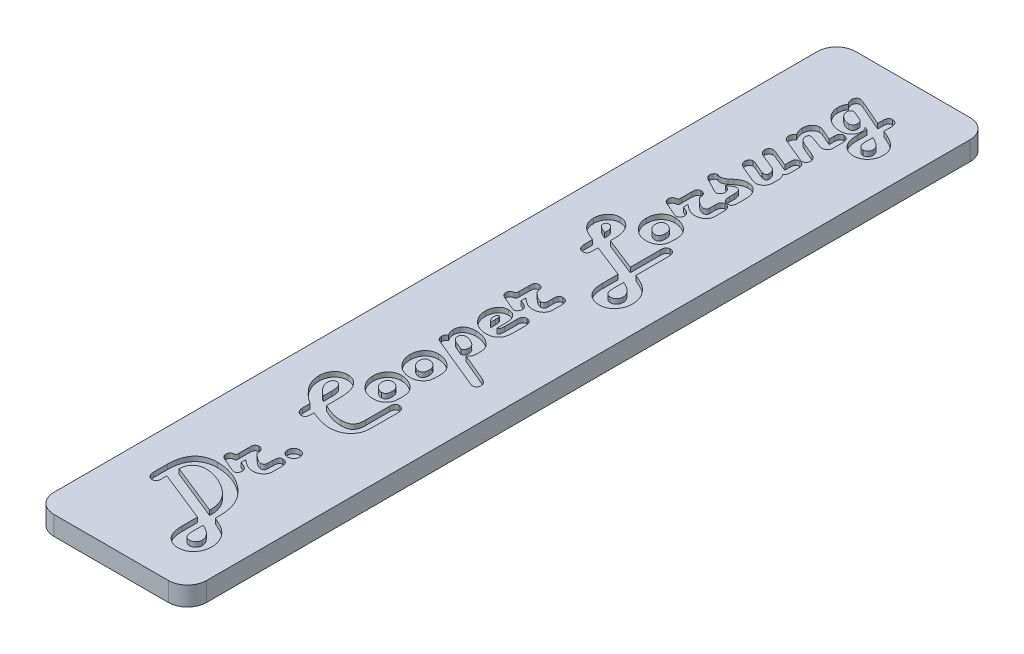
from build123d import *

# Parameters (mm, degrees)
BOSS_EXTRUDE1_DEPTH      = 66.675
BOSS_EXTRUDE1_DEPTH_BACK = 66.675
SKETCH3_W                = 25.4
SKETCH3_H                = 3.175
SKETCH5_OUTSIDE_W        = 54.556
SKETCH5_OUTSIDE_H        = 162.506
CUT_EXTRUDE2_DEPTH       = 68.947967225
CUT_EXTRUDE1_DEPTH       = 0.79375


with BuildPart() as part:
    # Sketch3 → Boss-Extrude1 (new, two sides: drawn at the far end of the back side and taken through both)
    with BuildSketch(Plane.XY.offset(-BOSS_EXTRUDE1_DEPTH_BACK)):
        Rectangle(SKETCH3_W, SKETCH3_H)
    extrude(amount=BOSS_EXTRUDE1_DEPTH + BOSS_EXTRUDE1_DEPTH_BACK)

    # Sketch5 outside → Cut-Extrude2 (cut, through all)
    with BuildSketch(Plane(origin=(0, 1.5875, 0), x_dir=(1, 0, 0), z_dir=(0, 1, 0))):
        Rectangle(SKETCH5_OUTSIDE_W, SKETCH5_OUTSIDE_H)
        with BuildLine():
            Line((-9.525, 66.675), (9.525, 66.675))
            ThreePointArc((9.525, 66.675), (11.77006403, 65.74506403), (12.7, 63.5))
            Line((12.7, 63.5), (12.7, -63.5))
            ThreePointArc((12.7, -63.5), (11.77006403, -65.74506403), (9.525, -66.675))
            Line((9.525, -66.675), (-9.525, -66.675))
            ThreePointArc((-9.525, -66.675), (-11.77006403, -65.74506403), (-12.7, -63.5))
            Line((-12.7, -63.5), (-12.7, 63.5))
            ThreePointArc((-12.7, 63.5), (-11.77006403, 65.74506403), (-9.525, 66.675))
        make_face(mode=Mode.SUBTRACT)
    extrude(amount=-CUT_EXTRUDE2_DEPTH, mode=Mode.SUBTRACT)

    # Sketch4 → Cut-Extrude1 (cut)
    # profile 1 of 16: a face of its own
    with BuildSketch(Plane(origin=(0, 1.5875, 0), x_dir=(1, 0, 0), z_dir=(0, 1, 0))):
        with BuildLine():
            Line((-5.679178082, -51.725171233), (-5.679178082, -52.440068493))
            Line((-5.679178082, -52.440068493), (-5.679178082, -52.63484589))
            add(Edge.make_bspline(
                [(-5.679178082, -52.63484589), (-5.681139035, -52.702031865), (-5.684812377, -52.827887587), (-5.713924446, -53.004101972), (-5.764512562, -53.154860106), (-5.837559677, -53.279472292), (-5.932023683, -53.378342086), (-6.050370432, -53.445545854), (-6.187957449, -53.487377556), (-6.286731391, -53.491167316), (-6.338424658, -53.493150685)],
                knots=[0, 0, 0, 0, 1.305737749, 2.445965353, 3.459324035, 4.379959175, 5.233349143, 6.085046436, 6.997810513, 8, 8, 8, 8], degree=3))
            add(Edge.make_bspline(
                [(-6.338424658, -53.493150685), (-6.405985442, -53.489134678), (-6.539317941, -53.481209013), (-6.730590117, -53.414680999), (-6.900338749, -53.300943843), (-7.049639341, -53.151193025), (-7.170453869, -52.969521798), (-7.259374763, -52.764555636), (-7.314351235, -52.53995592), (-7.320079852, -52.383307764), (-7.323013699, -52.303082192)],
                knots=[0, 0, 0, 0, 0.941902933, 1.858863449, 2.78744378, 3.773831386, 4.79357467, 5.815409039, 6.881186575, 8, 8, 8, 8], degree=3))
            Line((-7.323013699, -52.303082192), (-7.323013699, -52.108304795))
            Line((-7.323013699, -52.108304795), (-7.323013699, -49.991438356))
            add(Edge.make_bspline(
                [(-7.323013699, -49.991438356), (-7.320475549, -49.817239364), (-7.3155453, -49.478865156), (-7.267820653, -48.987359177), (-7.18958523, -48.527017951), (-7.078704255, -48.097981516), (-6.936975313, -47.699686131), (-6.766991285, -47.330627424), (-6.559923115, -46.995561123), (-6.323501854, -46.691529535), (-6.057697159, -46.42058692), (-5.762245196, -46.185576106), (-5.438747353, -45.987265421), (-5.08679158, -45.826810895), (-4.708155717, -45.699834267), (-4.301971757, -45.611316794), (-3.868472678, -45.556438051), (-3.570331213, -45.550832518), (-3.416763699, -45.547945205)],
                knots=[0, 0, 0, 0, 1.240121913, 2.408884614, 3.512215636, 4.562072732, 5.559962685, 6.519078054, 7.449661058, 8.358196616, 9.256317547, 10.145746268, 11.039719344, 11.951275398, 12.894325228, 13.877939151, 14.906963136, 16, 16, 16, 16], degree=3))
            add(Edge.make_bspline(
                [(-3.416763699, -45.547945205), (-3.178865588, -45.553402665), (-2.706260316, -45.564244382), (-2.005222822, -45.660657736), (-1.318852245, -45.811397993), (-0.648003468, -46.025174795), (0.007875584, -46.297601799), (0.646543553, -46.634503168), (1.273595063, -47.027543441), (1.667793593, -47.333816499), (1.867910959, -47.489297945)],
                knots=[0, 0, 0, 0, 0.99369571, 1.974062893, 2.951324249, 3.9272385, 4.912259598, 5.915104549, 6.941589699, 8, 8, 8, 8], degree=3))
            add(Edge.make_bspline(
                [(1.867910959, -47.489297945), (1.978197285, -47.580765654), (2.196111311, -47.761496098), (2.499418667, -48.051513729), (2.779873067, -48.348986907), (3.039382379, -48.654359932), (3.273370418, -48.970457926), (3.486715378, -49.294283847), (3.675652207, -49.627747183), (3.843402214, -49.971374449), (3.989712633, -50.328006855), (4.113540628, -50.701072491), (4.220514455, -51.090322207), (4.308869798, -51.497455776), (4.373145314, -51.921629976), (4.424054428, -52.36196814), (4.450629208, -52.820020779), (4.455387373, -53.131392666), (4.457808219, -53.289811644)],
                knots=[0, 0, 0, 0, 1.041972891, 2.058827374, 3.050103684, 4.014970579, 4.971989252, 5.909071109, 6.834104011, 7.757898592, 8.688895906, 9.635856426, 10.615406742, 11.624176682, 12.664286734, 13.734882699, 14.847559518, 16, 16, 16, 16], degree=3))
            Line((4.457808219, -53.289811644), (4.457808219, -53.799229452))
            Line((4.457808219, -53.799229452), (4.663287671, -53.886986301))
            add(Edge.make_bspline(
                [(4.663287671, -53.886986301), (4.755305177, -53.928408492), (4.932339916, -54.008101661), (5.188267535, -54.122507433), (5.420463771, -54.234785205), (5.633030062, -54.33687823), (5.82373241, -54.432911524), (5.99217766, -54.523339049), (6.141385488, -54.603534644), (6.310069605, -54.707233742), (6.506008189, -54.841386667), (6.734132992, -55.016792933), (6.95674715, -55.21628031), (7.097822135, -55.362258546), (7.169708904, -55.436643836)],
                knots=[0, 0, 0, 0, 1.222800361, 2.352575644, 3.396669397, 4.347862466, 5.210067408, 5.983579217, 6.664594993, 7.262130753, 8.381971782, 9.540587582, 10.746771362, 12, 12, 12, 12], degree=3))
            add(Edge.make_bspline(
                [(7.169708904, -55.436643836), (7.259252012, -55.53791001), (7.435529099, -55.737265459), (7.665799852, -56.05783035), (7.858042816, -56.390630983), (8.019190077, -56.732727855), (8.140760579, -57.087666382), (8.228695229, -57.453783957), (8.284253944, -57.830774747), (8.290354057, -58.086282752), (8.293424658, -58.21489726)],
                knots=[0, 0, 0, 0, 1.055914228, 2.078702545, 3.078046045, 4.055880218, 5.029205391, 6.004237832, 6.995397536, 8, 8, 8, 8], degree=3))
            add(Edge.make_bspline(
                [(8.293424658, -58.21489726), (8.290620622, -58.319852841), (8.285111992, -58.526041891), (8.251873776, -58.827907315), (8.191027588, -59.114953991), (8.107560104, -59.388021275), (8.000632184, -59.64777021), (7.869465324, -59.893048607), (7.714553896, -60.123236539), (7.537138339, -60.336639052), (7.341577706, -60.530357422), (7.131886859, -60.700387417), (6.908215426, -60.843048335), (6.672939661, -60.962041942), (6.422108099, -61.050933428), (6.160276549, -61.118552522), (5.884472994, -61.157164799), (5.696509044, -61.1619478), (5.600787671, -61.164383562)],
                knots=[0, 0, 0, 0, 1.126201464, 2.212463691, 3.25287726, 4.269850786, 5.272053028, 6.261782411, 7.249022054, 8.243830034, 9.23438794, 10.19795826, 11.134388982, 12.075812372, 13.02018767, 13.98375799, 14.973220915, 16, 16, 16, 16], degree=3))
            add(Edge.make_bspline(
                [(5.600787671, -61.164383562), (5.481962949, -61.160841647), (5.246551589, -61.153824531), (4.901392086, -61.080074536), (4.565645333, -60.972460663), (4.247078567, -60.81543267), (3.950050697, -60.622261328), (3.685416052, -60.39393496), (3.453108861, -60.134286952), (3.329976245, -59.938452387), (3.267739726, -59.839469178)],
                knots=[0, 0, 0, 0, 1.014242392, 2.009381349, 3.004557683, 4.021967388, 5.035219112, 6.025505851, 7.00200576, 8, 8, 8, 8], degree=3))
            add(Edge.make_bspline(
                [(3.267739726, -59.839469178), (3.230782911, -59.770883498), (3.155401117, -59.630987469), (3.064407715, -59.404675982), (2.987950753, -59.161796409), (2.922935082, -58.901818464), (2.875444298, -58.624034115), (2.838346721, -58.329172715), (2.817034776, -58.016870731), (2.815010595, -57.802543269), (2.813972603, -57.692636986)],
                knots=[0, 0, 0, 0, 0.84245226, 1.718372183, 2.633912599, 3.596293803, 4.615457363, 5.681185209, 6.810920853, 8, 8, 8, 8], degree=3))
            Line((2.813972603, -57.692636986), (2.813972603, -55.128424658))
            Line((2.813972603, -55.128424658), (-5.679178082, -51.725171233))
        make_face()
        with BuildLine():
            Line((2.813972603, -53.097174658), (2.813972603, -52.808219178))
            add(Edge.make_bspline(
                [(2.813972603, -52.808219178), (2.812229985, -52.715413987), (2.808779397, -52.531648868), (2.784155566, -52.258717703), (2.746792266, -51.991103422), (2.6903681, -51.729692316), (2.619740112, -51.474520953), (2.534172231, -51.224633325), (2.430309071, -50.980882243), (2.314188361, -50.740790222), (2.17712634, -50.509242988), (2.028104247, -50.282030043), (1.861775087, -50.061495191), (1.683460875, -49.84422437), (1.483489685, -49.637439359), (1.273647666, -49.430732234), (1.042967987, -49.234365248), (0.88166229, -49.108975874), (0.79984589, -49.045376712)],
                knots=[0, 0, 0, 0, 1.003752549, 1.98754731, 2.96218803, 3.924869515, 4.877913061, 5.824875223, 6.779479857, 7.742439712, 8.707376773, 9.687714611, 10.680189018, 11.694008127, 12.725763052, 13.790025714, 14.879071578, 16, 16, 16, 16], degree=3))
            add(Edge.make_bspline(
                [(0.79984589, -49.045376712), (0.637495563, -48.92719295), (0.31362577, -48.691430257), (-0.202532711, -48.38493724), (-0.736886345, -48.113288115), (-1.286214939, -47.885272589), (-1.833665188, -47.6995754), (-2.367354317, -47.565352513), (-2.880398896, -47.48127963), (-3.216699298, -47.470836228), (-3.380376712, -47.465753425)],
                knots=[0, 0, 0, 0, 1.061151743, 2.116872814, 3.169496409, 4.227969904, 5.258553914, 6.222792805, 7.135033211, 8, 8, 8, 8], degree=3))
            add(Edge.make_bspline(
                [(-3.380376712, -47.465753425), (-3.46678892, -47.467146718), (-3.635806387, -47.469871921), (-3.882804511, -47.498512158), (-4.115991615, -47.544225384), (-4.334080712, -47.611915609), (-4.538944612, -47.695032065), (-4.730305436, -47.79774106), (-4.906157833, -47.920722958), (-5.067898235, -48.059693115), (-5.2103847, -48.216965692), (-5.338824533, -48.38577569), (-5.442726671, -48.57112789), (-5.529114219, -48.768332376), (-5.598907159, -48.978609622), (-5.64329496, -49.203783202), (-5.675977303, -49.441116241), (-5.678092042, -49.603900778), (-5.679178082, -49.6875)],
                knots=[0, 0, 0, 0, 1.145531499, 2.240595844, 3.292755274, 4.292422607, 5.264114043, 6.220902991, 7.165828125, 8.104908158, 9.042461542, 9.975419986, 10.911970153, 11.852526766, 12.827988561, 13.843075609, 14.892295267, 16, 16, 16, 16], degree=3))
            Line((-5.679178082, -49.6875), (2.813972603, -53.097174658))
        make_face(mode=Mode.SUBTRACT)
        with BuildLine():
            Line((4.457808219, -55.828339041), (4.457808219, -57.744006849))
            add(Edge.make_bspline(
                [(4.457808219, -57.744006849), (4.460994809, -57.851224943), (4.466957488, -58.051849157), (4.512836115, -58.332607159), (4.591499209, -58.572387336), (4.709872635, -58.768025513), (4.858337145, -58.924864896), (5.044659494, -59.033393198), (5.262554621, -59.09917104), (5.418357057, -59.10600151), (5.500188356, -59.109589041)],
                knots=[0, 0, 0, 0, 1.31364871, 2.458071474, 3.475829816, 4.38621616, 5.23967168, 6.094559773, 6.99921559, 8, 8, 8, 8], degree=3))
            add(Edge.make_bspline(
                [(5.500188356, -59.109589041), (5.569155028, -59.106179577), (5.703961188, -59.099515246), (5.896015584, -59.038378173), (6.072433285, -58.94310595), (6.223360846, -58.806845603), (6.353187059, -58.648040007), (6.446221691, -58.465692393), (6.501322507, -58.265858339), (6.508778068, -58.127489487), (6.51260274, -58.056506849)],
                knots=[0, 0, 0, 0, 1.015443884, 1.984844108, 2.946375274, 3.953924431, 4.965428653, 5.959234333, 6.953095811, 8, 8, 8, 8], degree=3))
            add(Edge.make_bspline(
                [(6.51260274, -58.056506849), (6.510944819, -58.002188975), (6.507632271, -57.89366118), (6.481106386, -57.73211867), (6.436939997, -57.572921581), (6.380697586, -57.413945211), (6.301924225, -57.259157604), (6.206309798, -57.107291683), (6.098402384, -56.953987159), (5.922661518, -56.756046963), (5.670783127, -56.515524097), (5.316162311, -56.256945079), (4.909349592, -56.021931541), (4.611992169, -55.894443407), (4.457808219, -55.828339041)],
                knots=[0, 0, 0, 0, 0.609246736, 1.21728261, 1.830931323, 2.461525313, 3.105941494, 3.774613737, 4.474427454, 5.206422339, 6.740961797, 8.372497183, 10.119089455, 12, 12, 12, 12], degree=3))
        make_face(mode=Mode.SUBTRACT)
    # profile 2 of 16: a face of its own
    with BuildSketch(Plane(origin=(0, 1.5875, 0), x_dir=(1, 0, 0), z_dir=(0, 1, 0))):
        with BuildLine():
            Line((-1.43260274, -43.610873288), (-0.846130137, -43.865582192))
            add(Edge.make_bspline(
                [(-0.846130137, -43.865582192), (-0.784113415, -43.894300642), (-0.665976306, -43.949007093), (-0.507163435, -44.046730925), (-0.36948265, -44.146728687), (-0.257336482, -44.255974718), (-0.16943101, -44.372552179), (-0.108767407, -44.496943349), (-0.07035756, -44.627450334), (-0.065291412, -44.717206532), (-0.062739726, -44.762414384)],
                knots=[0, 0, 0, 0, 1.297501196, 2.471640463, 3.537215363, 4.524637192, 5.43567625, 6.296618738, 7.14205136, 8, 8, 8, 8], degree=3))
            add(Edge.make_bspline(
                [(-0.062739726, -44.762414384), (-0.064249291, -44.816182298), (-0.067186018, -44.920783085), (-0.105649348, -45.0694785), (-0.163102956, -45.206333115), (-0.246876118, -45.32378118), (-0.34425513, -45.424073782), (-0.457491489, -45.49671737), (-0.583595576, -45.538757147), (-0.671025425, -45.54484424), (-0.715565068, -45.547945205)],
                knots=[0, 0, 0, 0, 1.131994738, 2.202197021, 3.220602635, 4.248319073, 5.22801886, 6.155513921, 7.060358075, 8, 8, 8, 8], degree=3))
            add(Edge.make_bspline(
                [(-0.715565068, -45.547945205), (-0.747081309, -45.54515332), (-0.820370025, -45.538660994), (-0.942225513, -45.506057826), (-1.090708332, -45.452937415), (-1.198044875, -45.40928596), (-1.257089041, -45.385273973)],
                knots=[0, 0, 0, 0, 0.667539348, 1.552314029, 2.65356594, 4, 4, 4, 4], degree=3))
            Line((-1.257089041, -45.385273973), (-3.19630137, -44.55265411))
            add(Edge.make_bspline(
                [(-3.19630137, -44.55265411), (-3.251910738, -44.527542728), (-3.358097521, -44.479592231), (-3.500931864, -44.389948755), (-3.62350436, -44.29500323), (-3.724073706, -44.190743298), (-3.802724918, -44.079204127), (-3.856319972, -43.958228287), (-3.893260946, -43.830657664), (-3.896639037, -43.741705345), (-3.898356164, -43.696489726)],
                knots=[0, 0, 0, 0, 1.242093141, 2.371792344, 3.427691145, 4.394328043, 5.313892613, 6.192305435, 7.081125362, 8, 8, 8, 8], degree=3))
            add(Edge.make_bspline(
                [(-3.898356164, -43.696489726), (-3.896510838, -43.652885719), (-3.893007731, -43.570109282), (-3.872120133, -43.451388415), (-3.833957565, -43.346139358), (-3.779281238, -43.254113402), (-3.709475187, -43.174734568), (-3.622457216, -43.111420161), (-3.521903931, -43.057890273), (-3.447254499, -43.035903136), (-3.408202055, -43.024400685)],
                knots=[0, 0, 0, 0, 1.15314347, 2.189090296, 3.173792814, 4.095790583, 5.004376053, 5.947550008, 6.926271946, 8, 8, 8, 8], degree=3))
            Line((-3.408202055, -43.024400685), (-3.192020548, -42.964469178))
            add(Edge.make_bspline(
                [(-3.192020548, -42.964469178), (-3.166012398, -42.957534426), (-3.118375193, -42.944832553), (-3.056598309, -42.914357521), (-3.010020126, -42.878662157), (-2.976955035, -42.830502205), (-2.959433608, -42.762806915), (-2.948144639, -42.668769531), (-2.939675458, -42.543646295), (-2.939531558, -42.449354971), (-2.939452055, -42.397260274)],
                knots=[0, 0, 0, 0, 0.926850573, 1.697643703, 2.362895762, 2.92973869, 3.677374781, 4.746381598, 6.202419277, 8, 8, 8, 8], degree=3))
            Line((-2.939452055, -42.397260274), (-2.939452055, -40.706335616))
            add(Edge.make_bspline(
                [(-2.939452055, -40.706335616), (-2.937570141, -40.634862183), (-2.934050522, -40.501190157), (-2.904069677, -40.31407635), (-2.856572636, -40.154489854), (-2.788575116, -40.021262515), (-2.695673752, -39.919243603), (-2.582883881, -39.846500402), (-2.450261525, -39.802409732), (-2.35546974, -39.797229819), (-2.305890411, -39.794520548)],
                knots=[0, 0, 0, 0, 1.361355543, 2.546053047, 3.599677592, 4.524244374, 5.371169927, 6.197098625, 7.057021238, 8, 8, 8, 8], degree=3))
            add(Edge.make_bspline(
                [(-2.305890411, -39.794520548), (-2.236908431, -39.796949589), (-2.105643936, -39.801571765), (-1.923598266, -39.859729665), (-1.766736412, -39.950718724), (-1.643256267, -40.085088585), (-1.544572999, -40.252398311), (-1.478735842, -40.456862673), (-1.43796965, -40.696141852), (-1.434471998, -40.867385791), (-1.43260274, -40.95890411)],
                knots=[0, 0, 0, 0, 0.994284648, 1.892005291, 2.734571892, 3.588753721, 4.500369607, 5.525254763, 6.677415825, 8, 8, 8, 8], degree=3))
            Line((-1.43260274, -40.95890411), (-1.361969178, -41.033818493))
            add(Edge.make_bspline(
                [(-1.361969178, -41.033818493), (-1.275640685, -41.119462816), (-1.110395067, -41.283398828), (-0.863701621, -41.505414242), (-0.631112245, -41.692806714), (-0.416532555, -41.848956104), (-0.213839595, -41.967871916), (-0.028186714, -42.054673771), (0.143696282, -42.111830906), (0.25510596, -42.119620683), (0.30755137, -42.123287671)],
                knots=[0, 0, 0, 0, 1.435762249, 2.748263184, 3.91660617, 4.961556361, 5.879059361, 6.685751502, 7.381325737, 8, 8, 8, 8], degree=3))
            add(Edge.make_bspline(
                [(0.30755137, -42.123287671), (0.353486324, -42.122379854), (0.440770679, -42.120654845), (0.561359469, -42.088044475), (0.668100093, -42.046230473), (0.75127153, -41.975827185), (0.818376722, -41.889633778), (0.864001338, -41.783590753), (0.892910502, -41.659631871), (0.89503041, -41.571249666), (0.896164384, -41.523972603)],
                knots=[0, 0, 0, 0, 1.140484469, 2.167117703, 3.098941929, 3.971150526, 4.846255631, 5.80154673, 6.824011975, 8, 8, 8, 8], degree=3))
            Line((0.896164384, -41.523972603), (0.896164384, -40.612157534))
            add(Edge.make_bspline(
                [(0.896164384, -40.612157534), (0.898182521, -40.537161029), (0.901949312, -40.397182347), (0.930142152, -40.200657935), (0.983520387, -40.034472536), (1.055151224, -39.895968918), (1.150718895, -39.788258794), (1.267698419, -39.711032515), (1.407306267, -39.664859554), (1.50724529, -39.660055396), (1.559691781, -39.657534247)],
                knots=[0, 0, 0, 0, 1.364190584, 2.546219988, 3.596843527, 4.525897283, 5.362221888, 6.186477391, 7.048290713, 8, 8, 8, 8], degree=3))
            add(Edge.make_bspline(
                [(1.559691781, -39.657534247), (1.633666212, -39.66140898), (1.775914151, -39.668859837), (1.975742682, -39.732546695), (2.149287601, -39.838279268), (2.291023797, -39.988168929), (2.40652937, -40.172404802), (2.482997056, -40.393434479), (2.533984606, -40.64407099), (2.537926761, -40.822341022), (2.54, -40.91609589)],
                knots=[0, 0, 0, 0, 0.982615473, 1.889504555, 2.759142238, 3.658944971, 4.610088785, 5.631441668, 6.75433984, 8, 8, 8, 8], degree=3))
            Line((2.54, -40.91609589), (2.54, -42.333047945))
            add(Edge.make_bspline(
                [(2.54, -42.333047945), (2.5383024, -42.389505233), (2.534977996, -42.50006532), (2.510384601, -42.66201107), (2.472968238, -42.816820881), (2.416521678, -42.963012983), (2.344926398, -43.101132479), (2.259558563, -43.232841881), (2.155710436, -43.354659896), (2.038215237, -43.46807492), (1.907947493, -43.569879575), (1.768882381, -43.660660136), (1.61926785, -43.735791742), (1.461132501, -43.798144302), (1.292391004, -43.845025714), (1.114822727, -43.878641974), (0.928132827, -43.901205408), (0.800627218, -43.903129048), (0.735633562, -43.904109589)],
                knots=[0, 0, 0, 0, 1.009407673, 1.976719137, 2.923785669, 3.852797958, 4.771676065, 5.702527031, 6.65345443, 7.628144937, 8.618662201, 9.606215811, 10.593522047, 11.607757909, 12.641947342, 13.720607507, 14.838121302, 16, 16, 16, 16], degree=3))
            add(Edge.make_bspline(
                [(0.735633562, -43.904109589), (0.651262954, -43.901073935), (0.482172253, -43.894990054), (0.230972093, -43.850313577), (-0.017070175, -43.780013001), (-0.265153047, -43.675746777), (-0.523447633, -43.533453284), (-0.803548993, -43.349700863), (-1.111236787, -43.121962049), (-1.32133514, -42.950431318), (-1.43260274, -42.859589041)],
                knots=[0, 0, 0, 0, 0.822710096, 1.64882809, 2.481516469, 3.333299355, 4.267584386, 5.354441073, 6.598918144, 8, 8, 8, 8], degree=3))
            Line((-1.43260274, -42.859589041), (-1.43260274, -43.610873288))
        make_face()
    # profile 3 of 16: a face of its own
    with BuildSketch(Plane(origin=(0, 1.5875, 0), x_dir=(1, 0, 0), z_dir=(0, 1, 0))):
        with BuildLine():
            add(Edge.make_bspline(
                [(0.622191781, -37.940924658), (0.625798096, -37.872726126), (0.632835998, -37.739633298), (0.691439504, -37.547816369), (0.787228625, -37.371388996), (0.920147512, -37.21576395), (1.075772557, -37.082845063), (1.252199931, -36.987055942), (1.44401686, -36.928452436), (1.577109688, -36.921414534), (1.645308219, -36.917808219)],
                knots=[0, 0, 0, 0, 1.018015329, 1.986707578, 2.970091954, 4, 5.029908046, 6.013292422, 6.981984671, 8, 8, 8, 8], degree=3))
            add(Edge.make_bspline(
                [(1.645308219, -36.917808219), (1.714197217, -36.921495108), (1.849331034, -36.928727371), (2.044134079, -36.986612921), (2.223061144, -37.08222156), (2.378993595, -37.215822129), (2.511958868, -37.371374188), (2.607736163, -37.54782017), (2.66634272, -37.739632298), (2.673380202, -37.872725787), (2.676986301, -37.940924658)],
                knots=[0, 0, 0, 0, 1.023458974, 2.007634331, 2.995409192, 4.02013336, 5.044857529, 6.023292197, 6.987108688, 8, 8, 8, 8], degree=3))
            add(Edge.make_bspline(
                [(2.676986301, -37.940924658), (2.673299631, -38.009814), (2.666067797, -38.144948492), (2.608179119, -38.339746613), (2.512582459, -38.518692533), (2.378935452, -38.67455189), (2.223076095, -38.808198898), (2.044130175, -38.903795558), (1.849332054, -38.961684236), (1.714197562, -38.96891607), (1.645308219, -38.97260274)],
                knots=[0, 0, 0, 0, 1.018333356, 1.997579833, 2.980407786, 4, 5.019592214, 6.002420167, 6.981666644, 8, 8, 8, 8], degree=3))
            add(Edge.make_bspline(
                [(1.645308219, -38.97260274), (1.577109349, -38.96899664), (1.44401586, -38.961959158), (1.252203731, -38.903352601), (1.07575775, -38.807575306), (0.92020569, -38.674610033), (0.786605121, -38.518677583), (0.690996483, -38.339750517), (0.633110933, -38.144947472), (0.62587867, -38.009813656), (0.622191781, -37.940924658)],
                knots=[0, 0, 0, 0, 1.012891312, 1.976707803, 2.955142471, 3.97986664, 5.004590808, 5.992365669, 6.976541026, 8, 8, 8, 8], degree=3))
        make_face()
    # profile 4 of 16: a face of its own
    with BuildSketch(Plane(origin=(0, 1.5875, 0), x_dir=(1, 0, 0), z_dir=(0, 1, 0))):
        with BuildLine():
            add(Edge.make_bspline(
                [(-2.528493151, -28.321917808), (-2.381451474, -28.39533593), (-2.093160139, -28.539280211), (-1.658362689, -28.727884187), (-1.231015239, -28.886917454), (-0.812567052, -29.018075606), (-0.401456952, -29.119261316), (0.001508443, -29.192933547), (0.397182413, -29.236913329), (0.658476266, -29.243389698), (0.787003425, -29.246575342)],
                knots=[0, 0, 0, 0, 1.135220372, 2.225724058, 3.27216563, 4.283906486, 5.253382005, 6.19501987, 7.112152981, 8, 8, 8, 8], degree=3))
            add(Edge.make_bspline(
                [(0.787003425, -29.246575342), (0.874113697, -29.245828483), (1.042975432, -29.244380709), (1.285967888, -29.219580303), (1.510798668, -29.184120352), (1.71614208, -29.133908255), (1.901449634, -29.066838183), (2.069172576, -28.987990733), (2.216693157, -28.891990128), (2.345852371, -28.780061028), (2.459888494, -28.65276441), (2.552257576, -28.502556742), (2.635542637, -28.336421267), (2.700188334, -28.149771046), (2.752275951, -27.94431469), (2.786641773, -27.719210078), (2.811920652, -27.474884647), (2.813272483, -27.305296339), (2.813972603, -27.217465753)],
                knots=[0, 0, 0, 0, 1.252677985, 2.428294313, 3.509996311, 4.525739813, 5.464108595, 6.341009018, 7.186590139, 7.98710898, 8.794377844, 9.634395665, 10.515790431, 11.463822145, 12.469610459, 13.561444014, 14.737060343, 16, 16, 16, 16], degree=3))
            Line((2.813972603, -27.217465753), (2.813972603, -23.199914384))
            add(Edge.make_bspline(
                [(2.813972603, -23.199914384), (2.815823106, -23.126276866), (2.819290347, -22.988304158), (2.849695167, -22.795860247), (2.895144059, -22.630119647), (2.97043148, -22.496673466), (3.061710652, -22.388969177), (3.175967737, -22.311703045), (3.312562517, -22.268169679), (3.409402655, -22.262996825), (3.460376712, -22.260273973)],
                knots=[0, 0, 0, 0, 1.364812008, 2.557212865, 3.608126562, 4.532400877, 5.376541846, 6.206135691, 7.055757818, 8, 8, 8, 8], degree=3))
            add(Edge.make_bspline(
                [(3.460376712, -22.260273973), (3.535085119, -22.264062251), (3.678087557, -22.27131355), (3.879976633, -22.336004484), (4.056103631, -22.442550532), (4.200359811, -22.595163188), (4.317782569, -22.782425651), (4.399902419, -23.006062389), (4.448900311, -23.262725197), (4.454731832, -23.444398797), (4.457808219, -23.540239726)],
                knots=[0, 0, 0, 0, 0.976305263, 1.868786103, 2.745423265, 3.644143942, 4.593054588, 5.622217833, 6.745613821, 8, 8, 8, 8], degree=3))
            Line((4.457808219, -23.540239726), (4.457808219, -27.729023973))
            add(Edge.make_bspline(
                [(4.457808219, -27.729023973), (4.457299294, -27.81467275), (4.456306046, -27.981829794), (4.439505331, -28.225849064), (4.41975947, -28.457457718), (4.388319899, -28.675624048), (4.343712752, -28.87997493), (4.296715093, -29.072448286), (4.236463051, -29.25112544), (4.18813891, -29.363167104), (4.164571918, -29.417808219)],
                knots=[0, 0, 0, 0, 1.190131533, 2.322728638, 3.398279404, 4.420629422, 5.383336324, 6.304493289, 7.173125649, 8, 8, 8, 8], degree=3))
            add(Edge.make_bspline(
                [(4.164571918, -29.417808219), (4.12927286, -29.489737107), (4.059405033, -29.632106778), (3.935970799, -29.834506191), (3.798723956, -30.025660794), (3.646847073, -30.205164331), (3.481584179, -30.372643158), (3.3026005, -30.527836406), (3.109535479, -30.670686867), (2.905050494, -30.80345598), (2.689680119, -30.920932078), (2.464924286, -31.020944547), (2.234644049, -31.110983193), (1.993565054, -31.176815767), (1.747706306, -31.234432283), (1.493524727, -31.271795472), (1.231974364, -31.296224172), (1.054611948, -31.299638294), (0.964657534, -31.301369863)],
                knots=[0, 0, 0, 0, 0.978934421, 1.937616086, 2.893596785, 3.852754301, 4.808575882, 5.766781459, 6.745249647, 7.741853776, 8.744771607, 9.740039421, 10.747458991, 11.763260868, 12.791452619, 13.832398251, 14.900638884, 16, 16, 16, 16], degree=3))
            add(Edge.make_bspline(
                [(0.964657534, -31.301369863), (0.839706148, -31.297996563), (0.583493912, -31.291079626), (0.190123601, -31.24887218), (-0.220325796, -31.178462531), (-0.647902093, -31.074583387), (-1.094645889, -30.950462691), (-1.557747603, -30.791343758), (-2.039460853, -30.608393837), (-2.362802347, -30.467946075), (-2.528493151, -30.395976027)],
                knots=[0, 0, 0, 0, 0.825343589, 1.692363183, 2.610426493, 3.574010669, 4.597411306, 5.671867218, 6.806988276, 8, 8, 8, 8], degree=3))
            Line((-2.528493151, -30.395976027), (-2.528493151, -30.800513699))
            Line((-2.528493151, -30.800513699), (-2.528493151, -30.988869863))
            add(Edge.make_bspline(
                [(-2.528493151, -30.988869863), (-2.530501184, -31.05605286), (-2.534283744, -31.182606405), (-2.563062627, -31.359544006), (-2.613254321, -31.510639456), (-2.687477034, -31.633947832), (-2.781878451, -31.732080248), (-2.899000685, -31.802181179), (-3.037367494, -31.843376754), (-3.136079088, -31.84727495), (-3.187739726, -31.849315068)],
                knots=[0, 0, 0, 0, 1.304291175, 2.456911397, 3.46914742, 4.376890703, 5.229335235, 6.087167935, 6.998920798, 8, 8, 8, 8], degree=3))
            add(Edge.make_bspline(
                [(-3.187739726, -31.849315068), (-3.254747446, -31.845685072), (-3.386571057, -31.838543815), (-3.573333774, -31.766626555), (-3.744859157, -31.657191352), (-3.894497133, -31.50493703), (-4.01755869, -31.321529194), (-4.108333435, -31.115925476), (-4.16383445, -30.891167643), (-4.16944341, -30.735199025), (-4.172328767, -30.654965753)],
                knots=[0, 0, 0, 0, 0.931926633, 1.833369871, 2.756466935, 3.756871954, 4.790367599, 5.825255028, 6.881269148, 8, 8, 8, 8], degree=3))
            Line((-4.172328767, -30.654965753), (-4.172328767, -30.460188356))
            Line((-4.172328767, -30.460188356), (-4.172328767, -29.413527397))
            add(Edge.make_bspline(
                [(-4.172328767, -29.413527397), (-4.349965015, -29.298051509), (-4.7128797, -29.062131778), (-5.227847246, -28.644159805), (-5.739326425, -28.178138414), (-6.057764434, -27.831484605), (-6.220702055, -27.654109589)],
                knots=[0, 0, 0, 0, 0.937855809, 1.916059648, 2.933694244, 4, 4, 4, 4], degree=3))
            add(Edge.make_bspline(
                [(-6.220702055, -27.654109589), (-6.319973512, -27.537404433), (-6.514711002, -27.30846784), (-6.763759522, -26.941393644), (-6.980635425, -26.571830181), (-7.154137375, -26.191855113), (-7.293121873, -25.806527772), (-7.388675845, -25.412503286), (-7.449061744, -25.012578114), (-7.456345773, -24.743363477), (-7.46, -24.608304795)],
                knots=[0, 0, 0, 0, 1.092661291, 2.143437016, 3.160869329, 4.147355701, 5.120066962, 6.07960259, 7.036581562, 8, 8, 8, 8], degree=3))
            add(Edge.make_bspline(
                [(-7.46, -24.608304795), (-7.457911144, -24.520451469), (-7.453822804, -24.348503659), (-7.422740231, -24.096592207), (-7.374780601, -23.855413283), (-7.302810119, -23.626944508), (-7.216213889, -23.407427338), (-7.103366293, -23.203214526), (-6.974579421, -23.007945017), (-6.825402114, -22.827812728), (-6.661483458, -22.663497345), (-6.48503852, -22.518247315), (-6.296152905, -22.396967264), (-6.097791711, -22.294177836), (-5.886940123, -22.217045765), (-5.664685238, -22.16505972), (-5.432809831, -22.128369504), (-5.274075693, -22.125001473), (-5.193304795, -22.123287671)],
                knots=[0, 0, 0, 0, 1.119527251, 2.191155048, 3.230976227, 4.249298308, 5.240622722, 6.233531056, 7.217233973, 8.218643922, 9.208966661, 10.171979194, 11.125497735, 12.065035589, 13.014512214, 13.978426103, 14.971334436, 16, 16, 16, 16], degree=3))
            add(Edge.make_bspline(
                [(-5.193304795, -22.123287671), (-5.078838535, -22.127190213), (-4.85514808, -22.134816575), (-4.530564727, -22.200663597), (-4.227580088, -22.308970334), (-3.943236452, -22.457939058), (-3.680502861, -22.652139072), (-3.442510318, -22.891909479), (-3.220564302, -23.170034005), (-3.097391082, -23.380118872), (-3.033630137, -23.488869863)],
                knots=[0, 0, 0, 0, 1.018804761, 1.990952639, 2.935710558, 3.876656104, 4.840123917, 5.833253974, 6.878378157, 8, 8, 8, 8], degree=3))
            add(Edge.make_bspline(
                [(-3.033630137, -23.488869863), (-2.992727739, -23.570907855), (-2.907074777, -23.742702113), (-2.806608169, -24.028262724), (-2.719153439, -24.346474638), (-2.649966948, -24.699397998), (-2.594097455, -25.085076022), (-2.557296683, -25.505272104), (-2.533365076, -25.959339668), (-2.530155395, -26.273511172), (-2.528493151, -26.436215753)],
                knots=[0, 0, 0, 0, 0.728556699, 1.525657243, 2.402672044, 3.352039263, 4.384154211, 5.50114961, 6.705883877, 8, 8, 8, 8], degree=3))
            Line((-2.528493151, -26.436215753), (-2.528493151, -28.321917808))
        make_face()
        with BuildLine():
            Line((-4.172328767, -27.245291096), (-4.172328767, -25.845462329))
            add(Edge.make_bspline(
                [(-4.172328767, -25.845462329), (-4.173341358, -25.772682387), (-4.175308085, -25.631324014), (-4.184935525, -25.426957413), (-4.205312856, -25.236467357), (-4.229318295, -25.059622767), (-4.264266148, -24.896931482), (-4.30362276, -24.748237514), (-4.353783369, -24.614876969), (-4.408869559, -24.493879085), (-4.472047143, -24.387011333), (-4.544931266, -24.295146381), (-4.622405863, -24.215554916), (-4.710555697, -24.152251038), (-4.805187861, -24.103144538), (-4.907041893, -24.065781718), (-5.016878244, -24.044194091), (-5.092611909, -24.042142245), (-5.131232877, -24.04109589)],
                knots=[0, 0, 0, 0, 1.530225532, 2.972112734, 4.29893874, 5.556827136, 6.721764215, 7.795238361, 8.787123859, 9.713203311, 10.587806911, 11.388973238, 12.173826602, 12.91489056, 13.659588691, 14.409255044, 15.188787307, 16, 16, 16, 16], degree=3))
            add(Edge.make_bspline(
                [(-5.131232877, -24.04109589), (-5.179342248, -24.04401542), (-5.273297335, -24.04971711), (-5.408559201, -24.093747285), (-5.527650312, -24.171108773), (-5.630913341, -24.274945471), (-5.713399703, -24.401350068), (-5.77460971, -24.544594642), (-5.808442725, -24.704507968), (-5.813520077, -24.815770006), (-5.816164384, -24.873715753)],
                knots=[0, 0, 0, 0, 0.957212062, 1.869385084, 2.795725007, 3.760291457, 4.765249107, 5.783975308, 6.845884806, 8, 8, 8, 8], degree=3))
            add(Edge.make_bspline(
                [(-5.816164384, -24.873715753), (-5.810474434, -24.969166366), (-5.798719453, -25.166359695), (-5.708166102, -25.464805818), (-5.564093857, -25.771129136), (-5.369433677, -26.085096234), (-5.129010022, -26.396827736), (-4.846769283, -26.697155793), (-4.526627805, -26.982848255), (-4.292203498, -27.156495301), (-4.172328767, -27.245291096)],
                knots=[0, 0, 0, 0, 0.767354421, 1.585292851, 2.48966922, 3.487312267, 4.551994222, 5.652958552, 6.799821728, 8, 8, 8, 8], degree=3))
        make_face(mode=Mode.SUBTRACT)
    # profile 5 of 16: a face of its own
    with BuildSketch(Plane(origin=(0, 1.5875, 0), x_dir=(1, 0, 0), z_dir=(0, 1, 0))):
        with BuildLine():
            add(Edge.make_bspline(
                [(-2.939452055, -20.147688356), (-2.937340599, -20.061973584), (-2.933192491, -19.893580767), (-2.902269882, -19.647361043), (-2.854686397, -19.411477813), (-2.780142599, -19.189628195), (-2.690838506, -18.977178424), (-2.578837068, -18.778143327), (-2.447212585, -18.590043706), (-2.296182473, -18.416154482), (-2.129262976, -18.257631488), (-1.950450091, -18.11841789), (-1.759077595, -18.001640912), (-1.558781037, -17.904776995), (-1.345711617, -17.832035566), (-1.12298144, -17.778439558), (-0.888483059, -17.745606153), (-0.728513502, -17.741709725), (-0.647071918, -17.739726027)],
                knots=[0, 0, 0, 0, 1.103971081, 2.168830371, 3.192796702, 4.19853072, 5.178566245, 6.157954981, 7.134622528, 8.13162389, 9.119900924, 10.09617911, 11.045205717, 12.003137743, 12.956605303, 13.939782458, 14.951129296, 16, 16, 16, 16], degree=3))
            add(Edge.make_bspline(
                [(-0.647071918, -17.739726027), (-0.521208599, -17.743707615), (-0.26845337, -17.75170333), (0.10860876, -17.821517305), (0.483392704, -17.933104986), (0.849112365, -18.08994559), (1.199072078, -18.275547162), (1.515078635, -18.496198151), (1.797932159, -18.738819122), (1.955122318, -18.925427937), (2.032722603, -19.01755137)],
                knots=[0, 0, 0, 0, 0.985331903, 1.97871623, 2.993784644, 4.043324233, 5.09119552, 6.091271912, 7.057715548, 8, 8, 8, 8], degree=3))
            add(Edge.make_bspline(
                [(2.032722603, -19.01755137), (2.078036022, -19.080319846), (2.166772773, -19.203238638), (2.279300317, -19.396831774), (2.366701041, -19.594652357), (2.436676678, -19.800471851), (2.483201963, -20.029867655), (2.51584338, -20.292435811), (2.537568814, -20.595393126), (2.539156807, -20.810460793), (2.54, -20.924657534)],
                knots=[0, 0, 0, 0, 0.921254077, 1.804081356, 2.659560611, 3.492177375, 4.386734262, 5.440228603, 6.640811263, 8, 8, 8, 8], degree=3))
            add(Edge.make_bspline(
                [(2.54, -20.924657534), (2.5392631, -21.019565512), (2.537855038, -21.200914659), (2.524992177, -21.460815808), (2.504199699, -21.696558764), (2.474647226, -21.908816315), (2.437251353, -22.097224597), (2.390095481, -22.261136749), (2.336383521, -22.402327882), (2.288481844, -22.483400441), (2.266027397, -22.52140411)],
                knots=[0, 0, 0, 0, 1.39041541, 2.656790854, 3.811370106, 4.856520238, 5.795436321, 6.622484863, 7.354274382, 8, 8, 8, 8], degree=3))
            add(Edge.make_bspline(
                [(2.266027397, -22.52140411), (2.210706866, -22.598427019), (2.101763773, -22.750108748), (1.910023297, -22.950837014), (1.69694738, -23.118642464), (1.464464612, -23.254714234), (1.214537303, -23.36260617), (0.944283837, -23.440084686), (0.654374304, -23.484864895), (0.454682473, -23.490345999), (0.3525, -23.493150685)],
                knots=[0, 0, 0, 0, 1.013819869, 1.996522248, 2.958697901, 3.90662464, 4.870948177, 5.864004237, 6.907009222, 8, 8, 8, 8], degree=3))
            add(Edge.make_bspline(
                [(0.3525, -23.493150685), (0.243155158, -23.490521573), (0.026282159, -23.48530703), (-0.292644085, -23.436099001), (-0.600984711, -23.360353369), (-0.896271579, -23.248594896), (-1.182209346, -23.110478934), (-1.454805294, -22.936812213), (-1.717534066, -22.734702098), (-1.964930964, -22.503399577), (-2.19156019, -22.251050712), (-2.393260767, -21.985396545), (-2.558992557, -21.705227845), (-2.70100172, -21.417458188), (-2.808651784, -21.115778671), (-2.881435108, -20.802439691), (-2.93202876, -20.478939371), (-2.936953343, -20.259188833), (-2.939452055, -20.147688356)],
                knots=[0, 0, 0, 0, 1.007797798, 1.998851768, 2.969155317, 3.931055872, 4.905122675, 5.892763132, 6.906173297, 7.958361136, 9.01137164, 10.031276384, 11.028840275, 12.008823124, 12.987014998, 13.974918451, 14.972482342, 16, 16, 16, 16], degree=3))
        make_face()
        with BuildLine():
            add(Edge.make_bspline(
                [(-1.295616438, -20.314640411), (-1.290413225, -20.409454813), (-1.279986727, -20.599449386), (-1.18975315, -20.876059594), (-1.041572634, -21.136874778), (-0.845828043, -21.377120343), (-0.61764031, -21.584016763), (-0.366238139, -21.73559289), (-0.102387694, -21.832088286), (0.079892321, -21.843592468), (0.170565068, -21.849315068)],
                knots=[0, 0, 0, 0, 0.975806903, 1.955378207, 2.966488235, 4.054561247, 5.138397878, 6.125043581, 7.067328091, 8, 8, 8, 8], degree=3))
            add(Edge.make_bspline(
                [(0.170565068, -21.849315068), (0.227398075, -21.847200037), (0.33635093, -21.843145373), (0.487671949, -21.790947568), (0.618774182, -21.711658483), (0.721904897, -21.594066339), (0.800673149, -21.447389681), (0.858480459, -21.270055044), (0.891337971, -21.061430739), (0.894491326, -20.911936301), (0.896164384, -20.832619863)],
                knots=[0, 0, 0, 0, 0.956805885, 1.834263912, 2.674438196, 3.520051675, 4.443416229, 5.473475652, 6.659515948, 8, 8, 8, 8], degree=3))
            add(Edge.make_bspline(
                [(0.896164384, -20.832619863), (0.892465056, -20.738883887), (0.885450192, -20.561136675), (0.833245626, -20.310252765), (0.739759465, -20.092463143), (0.646235678, -19.974061436), (0.600787671, -19.916523973)],
                knots=[0, 0, 0, 0, 1.142441295, 2.16635878, 3.108939658, 4, 4, 4, 4], degree=3))
            add(Edge.make_bspline(
                [(0.600787671, -19.916523973), (0.560769428, -19.874490739), (0.482373218, -19.792147138), (0.35582604, -19.681864723), (0.223117923, -19.590409521), (0.087357931, -19.514142523), (-0.052691575, -19.455698133), (-0.197990858, -19.415334558), (-0.347134293, -19.38840504), (-0.448612038, -19.385176802), (-0.499383562, -19.383561644)],
                knots=[0, 0, 0, 0, 1.104541147, 2.16380913, 3.188642432, 4.167531797, 5.123537843, 6.069455881, 7.034106787, 8, 8, 8, 8], degree=3))
            add(Edge.make_bspline(
                [(-0.499383562, -19.383561644), (-0.556035746, -19.387077428), (-0.666402121, -19.393926668), (-0.824421323, -19.440860911), (-0.962916636, -19.526257417), (-1.082485009, -19.639851347), (-1.179222062, -19.778955278), (-1.245620117, -19.941328877), (-1.290153564, -20.121041205), (-1.293756152, -20.248713583), (-1.295616438, -20.314640411)],
                knots=[0, 0, 0, 0, 0.98903142, 1.926771468, 2.843174583, 3.803555391, 4.788263585, 5.77611782, 6.851642778, 8, 8, 8, 8], degree=3))
        make_face(mode=Mode.SUBTRACT)
    # profile 6 of 16: a face of its own
    with BuildSketch(Plane(origin=(0, 1.5875, 0), x_dir=(1, 0, 0), z_dir=(0, 1, 0))):
        with BuildLine():
            add(Edge.make_bspline(
                [(-2.939452055, -13.983304795), (-2.937340599, -13.897590022), (-2.933192491, -13.729197205), (-2.902269882, -13.482977482), (-2.854686397, -13.247094252), (-2.780142599, -13.025244633), (-2.690838506, -12.812794863), (-2.578837068, -12.613759766), (-2.447212585, -12.425660145), (-2.296182473, -12.25177092), (-2.129262976, -12.093247926), (-1.950450091, -11.954034328), (-1.759077595, -11.837257351), (-1.558781037, -11.740393433), (-1.345711617, -11.667652005), (-1.12298144, -11.614055996), (-0.888483059, -11.581222592), (-0.728513502, -11.577326164), (-0.647071918, -11.575342466)],
                knots=[0, 0, 0, 0, 1.103971081, 2.168830371, 3.192796702, 4.19853072, 5.178566245, 6.157954981, 7.134622528, 8.13162389, 9.119900924, 10.09617911, 11.045205717, 12.003137743, 12.956605303, 13.939782458, 14.951129296, 16, 16, 16, 16], degree=3))
            add(Edge.make_bspline(
                [(-0.647071918, -11.575342466), (-0.521208599, -11.579324054), (-0.26845337, -11.587319769), (0.10860876, -11.657133743), (0.483392704, -11.768721424), (0.849112365, -11.925562029), (1.199072078, -12.111163601), (1.515078635, -12.331814589), (1.797932159, -12.57443556), (1.955122318, -12.761044375), (2.032722603, -12.853167808)],
                knots=[0, 0, 0, 0, 0.985331903, 1.97871623, 2.993784644, 4.043324233, 5.09119552, 6.091271912, 7.057715548, 8, 8, 8, 8], degree=3))
            add(Edge.make_bspline(
                [(2.032722603, -12.853167808), (2.078036022, -12.915936285), (2.166772773, -13.038855077), (2.279300317, -13.232448212), (2.366701041, -13.430268795), (2.436676678, -13.636088289), (2.483201963, -13.865484094), (2.51584338, -14.128052249), (2.537568814, -14.431009564), (2.539156807, -14.646077232), (2.54, -14.760273973)],
                knots=[0, 0, 0, 0, 0.921254077, 1.804081356, 2.659560611, 3.492177375, 4.386734262, 5.440228603, 6.640811263, 8, 8, 8, 8], degree=3))
            add(Edge.make_bspline(
                [(2.54, -14.760273973), (2.5392631, -14.855181951), (2.537855038, -15.036531097), (2.524992177, -15.296432247), (2.504199699, -15.532175202), (2.474647226, -15.744432753), (2.437251353, -15.932841036), (2.390095481, -16.096753187), (2.336383521, -16.237944321), (2.288481844, -16.31901688), (2.266027397, -16.357020548)],
                knots=[0, 0, 0, 0, 1.39041541, 2.656790854, 3.811370106, 4.856520238, 5.795436321, 6.622484863, 7.354274382, 8, 8, 8, 8], degree=3))
            add(Edge.make_bspline(
                [(2.266027397, -16.357020548), (2.210706866, -16.434043457), (2.101763773, -16.585725187), (1.910023297, -16.786453452), (1.69694738, -16.954258902), (1.464464612, -17.090330672), (1.214537303, -17.198222608), (0.944283837, -17.275701124), (0.654374304, -17.320481333), (0.454682473, -17.325962438), (0.3525, -17.328767123)],
                knots=[0, 0, 0, 0, 1.013819869, 1.996522248, 2.958697901, 3.90662464, 4.870948177, 5.864004237, 6.907009222, 8, 8, 8, 8], degree=3))
            add(Edge.make_bspline(
                [(0.3525, -17.328767123), (0.243155158, -17.326138011), (0.026282159, -17.320923469), (-0.292644085, -17.271715439), (-0.600984711, -17.195969808), (-0.896271579, -17.084211335), (-1.182209346, -16.946095373), (-1.454805294, -16.772428652), (-1.717534066, -16.570318537), (-1.964930964, -16.339016016), (-2.19156019, -16.08666715), (-2.393260767, -15.821012983), (-2.558992557, -15.540844283), (-2.70100172, -15.253074626), (-2.808651784, -14.951395109), (-2.881435108, -14.638056129), (-2.93202876, -14.31455581), (-2.936953343, -14.094805271), (-2.939452055, -13.983304795)],
                knots=[0, 0, 0, 0, 1.007797798, 1.998851768, 2.969155317, 3.931055872, 4.905122675, 5.892763132, 6.906173297, 7.958361136, 9.01137164, 10.031276384, 11.028840275, 12.008823124, 12.987014998, 13.974918451, 14.972482342, 16, 16, 16, 16], degree=3))
        make_face()
        with BuildLine():
            add(Edge.make_bspline(
                [(-1.295616438, -14.150256849), (-1.290413225, -14.245071251), (-1.279986727, -14.435065824), (-1.18975315, -14.711676032), (-1.041572634, -14.972491216), (-0.845828043, -15.212736781), (-0.61764031, -15.419633202), (-0.366238139, -15.571209329), (-0.102387694, -15.667704724), (0.079892321, -15.679208906), (0.170565068, -15.684931507)],
                knots=[0, 0, 0, 0, 0.975806903, 1.955378207, 2.966488235, 4.054561247, 5.138397878, 6.125043581, 7.067328091, 8, 8, 8, 8], degree=3))
            add(Edge.make_bspline(
                [(0.170565068, -15.684931507), (0.227398075, -15.682816475), (0.33635093, -15.678761812), (0.487671949, -15.626564006), (0.618774182, -15.547274922), (0.721904897, -15.429682778), (0.800673149, -15.28300612), (0.858480459, -15.105671483), (0.891337971, -14.897047178), (0.894491326, -14.747552739), (0.896164384, -14.668236301)],
                knots=[0, 0, 0, 0, 0.956805885, 1.834263912, 2.674438196, 3.520051675, 4.443416229, 5.473475652, 6.659515948, 8, 8, 8, 8], degree=3))
            add(Edge.make_bspline(
                [(0.896164384, -14.668236301), (0.892465056, -14.574500325), (0.885450192, -14.396753113), (0.833245626, -14.145869203), (0.739759465, -13.928079582), (0.646235678, -13.809677875), (0.600787671, -13.752140411)],
                knots=[0, 0, 0, 0, 1.142441295, 2.16635878, 3.108939658, 4, 4, 4, 4], degree=3))
            add(Edge.make_bspline(
                [(0.600787671, -13.752140411), (0.560769428, -13.710107177), (0.482373218, -13.627763577), (0.35582604, -13.517481161), (0.223117923, -13.426025959), (0.087357931, -13.349758961), (-0.052691575, -13.291314571), (-0.197990858, -13.250950996), (-0.347134293, -13.224021478), (-0.448612038, -13.22079324), (-0.499383562, -13.219178082)],
                knots=[0, 0, 0, 0, 1.104541147, 2.16380913, 3.188642432, 4.167531797, 5.123537843, 6.069455881, 7.034106787, 8, 8, 8, 8], degree=3))
            add(Edge.make_bspline(
                [(-0.499383562, -13.219178082), (-0.556035746, -13.222693867), (-0.666402121, -13.229543106), (-0.824421323, -13.276477349), (-0.962916636, -13.361873855), (-1.082485009, -13.475467785), (-1.179222062, -13.614571716), (-1.245620117, -13.776945316), (-1.290153564, -13.956657644), (-1.293756152, -14.084330022), (-1.295616438, -14.150256849)],
                knots=[0, 0, 0, 0, 0.98903142, 1.926771468, 2.843174583, 3.803555391, 4.788263585, 5.77611782, 6.851642778, 8, 8, 8, 8], degree=3))
        make_face(mode=Mode.SUBTRACT)
    # profile 7 of 16: a face of its own
    with BuildSketch(Plane(origin=(0, 1.5875, 0), x_dir=(1, 0, 0), z_dir=(0, 1, 0))):
        with BuildLine():
            Line((1.98135274, -9.601883562), (6.529726027, -11.500428082))
            add(Edge.make_bspline(
                [(6.529726027, -11.500428082), (6.603901883, -11.533987028), (6.74633296, -11.598426281), (6.939888169, -11.713191785), (7.10265318, -11.84106977), (7.238569834, -11.978168552), (7.341981577, -12.130426075), (7.419258035, -12.292195602), (7.46277934, -12.467792999), (7.468554078, -12.588240751), (7.471506849, -12.649828767)],
                knots=[0, 0, 0, 0, 1.233199072, 2.367965567, 3.399677286, 4.363073182, 5.280732318, 6.175560857, 7.067117617, 8, 8, 8, 8], degree=3))
            add(Edge.make_bspline(
                [(7.471506849, -12.649828767), (7.470071279, -12.697234871), (7.467283149, -12.7893059), (7.42735657, -12.920580715), (7.370329221, -13.043279504), (7.286693965, -13.150054591), (7.188763113, -13.240608966), (7.078898919, -13.308661773), (6.957660659, -13.349011292), (6.873911122, -13.353760649), (6.831523973, -13.356164384)],
                knots=[0, 0, 0, 0, 1.07173702, 2.081502635, 3.088147668, 4.127722124, 5.136318652, 6.102700054, 7.039742318, 8, 8, 8, 8], degree=3))
            add(Edge.make_bspline(
                [(6.831523973, -13.356164384), (6.789262098, -13.353797331), (6.695053546, -13.348520789), (6.541364379, -13.309695154), (6.360165613, -13.251791307), (6.231222096, -13.201430842), (6.161575342, -13.174229452)],
                knots=[0, 0, 0, 0, 0.726678964, 1.619884938, 2.714419364, 4, 4, 4, 4], degree=3))
            Line((6.161575342, -13.174229452), (-2.299469178, -9.674657534))
            add(Edge.make_bspline(
                [(-2.299469178, -9.674657534), (-2.350079115, -9.651691031), (-2.448128485, -9.60719678), (-2.579911712, -9.521266623), (-2.69021031, -9.421532642), (-2.781999173, -9.311044096), (-2.853973751, -9.187705732), (-2.902695687, -9.050413942), (-2.933281652, -8.901884627), (-2.937359873, -8.798669765), (-2.939452055, -8.745719178)],
                knots=[0, 0, 0, 0, 1.105756702, 2.14224231, 3.118129428, 4.056898495, 4.992759649, 5.94572338, 6.946128963, 8, 8, 8, 8], degree=3))
            add(Edge.make_bspline(
                [(-2.939452055, -8.745719178), (-2.934025229, -8.672903887), (-2.92336336, -8.529846596), (-2.840248728, -8.327692397), (-2.699449249, -8.152463452), (-2.574628995, -8.065620964), (-2.509229452, -8.020119863)],
                knots=[0, 0, 0, 0, 0.987895729, 1.940879239, 2.92112416, 4, 4, 4, 4], degree=3))
            add(Edge.make_bspline(
                [(-2.509229452, -8.020119863), (-2.575640158, -7.93466068), (-2.707866599, -7.764507938), (-2.842123994, -7.466982742), (-2.923998339, -7.143396112), (-2.934193327, -6.91832242), (-2.939452055, -6.802226027)],
                knots=[0, 0, 0, 0, 0.981752114, 1.954708766, 2.94500805, 4, 4, 4, 4], degree=3))
            add(Edge.make_bspline(
                [(-2.939452055, -6.802226027), (-2.937816239, -6.741502726), (-2.934606316, -6.622346787), (-2.909066042, -6.447573871), (-2.863326486, -6.283028145), (-2.803303365, -6.12583211), (-2.72391783, -5.97863843), (-2.627163296, -5.840423732), (-2.51128672, -5.713604517), (-2.382251776, -5.593619554), (-2.236062522, -5.487851479), (-2.079436595, -5.392182588), (-1.91025293, -5.313947876), (-1.730388014, -5.249226887), (-1.54006598, -5.19779819), (-1.338117753, -5.161891678), (-1.125587447, -5.139986868), (-0.98031685, -5.138001251), (-0.906061644, -5.136986301)],
                knots=[0, 0, 0, 0, 0.98726222, 1.937281973, 2.86326486, 3.759553004, 4.667924465, 5.575628851, 6.495778717, 7.456506431, 8.435760083, 9.424657069, 10.436762075, 11.460701102, 12.530164814, 13.638445286, 14.79288903, 16, 16, 16, 16], degree=3))
            add(Edge.make_bspline(
                [(-0.906061644, -5.136986301), (-0.765345408, -5.140134839), (-0.489363268, -5.146309964), (-0.085242668, -5.198954813), (0.299733093, -5.284076329), (0.66508927, -5.403741963), (1.009111274, -5.558737361), (1.333461553, -5.746937475), (1.639246945, -5.968585661), (1.822671467, -6.142962173), (1.915, -6.230736301)],
                knots=[0, 0, 0, 0, 1.086031519, 2.129998023, 3.140303829, 4.126214445, 5.092667862, 6.047831746, 7.017356958, 8, 8, 8, 8], degree=3))
            add(Edge.make_bspline(
                [(1.915, -6.230736301), (1.971011074, -6.290424499), (2.07898433, -6.405486191), (2.218557256, -6.588277243), (2.325697879, -6.776300007), (2.410824431, -6.970970181), (2.472352069, -7.186688021), (2.50978545, -7.434697846), (2.536090806, -7.719186899), (2.538647315, -7.921588169), (2.54, -8.028681507)],
                knots=[0, 0, 0, 0, 0.999046829, 1.925875206, 2.799953021, 3.634916385, 4.514359877, 5.529679388, 6.692918864, 8, 8, 8, 8], degree=3))
            add(Edge.make_bspline(
                [(2.54, -8.028681507), (2.53910252, -8.140740761), (2.53745456, -8.346504986), (2.518059034, -8.626542677), (2.491810314, -8.851413743), (2.446736332, -9.030623904), (2.374505827, -9.181117967), (2.272125357, -9.321084151), (2.14117682, -9.465114216), (2.036684007, -9.554533868), (1.98135274, -9.601883562)],
                knots=[0, 0, 0, 0, 1.53519449, 2.818938113, 3.84486776, 4.63459067, 5.338636183, 6.117144677, 7.002986248, 8, 8, 8, 8], degree=3))
        make_face()
        with BuildLine():
            add(Edge.make_bspline(
                [(0.519452055, -9.011130137), (0.56942504, -8.983037691), (0.662110123, -8.930934527), (0.779853381, -8.842192962), (0.872388423, -8.759432186), (0.940890973, -8.672777417), (0.984282679, -8.57246362), (1.013898204, -8.454048485), (1.029353495, -8.313042093), (1.031829508, -8.211361796), (1.033150685, -8.157106164)],
                knots=[0, 0, 0, 0, 1.282554771, 2.378759122, 3.294627885, 4.058478904, 4.830807259, 5.722233376, 6.78460557, 8, 8, 8, 8], degree=3))
            add(Edge.make_bspline(
                [(1.033150685, -8.157106164), (1.028967314, -8.075910471), (1.020950281, -7.92030663), (0.949661262, -7.70040147), (0.83061796, -7.508207438), (0.717794987, -7.410368733), (0.660719178, -7.360873288)],
                knots=[0, 0, 0, 0, 1.066336539, 2.043532773, 3.010246346, 4, 4, 4, 4], degree=3))
            add(Edge.make_bspline(
                [(0.660719178, -7.360873288), (0.59863267, -7.314212314), (0.47684963, -7.222686547), (0.285508047, -7.104807262), (0.092478344, -7.006416148), (-0.100617206, -6.924818671), (-0.294700305, -6.858610009), (-0.491510493, -6.815237042), (-0.688958334, -6.785188767), (-0.821048239, -6.78227319), (-0.886797945, -6.780821918)],
                knots=[0, 0, 0, 0, 1.106882035, 2.17115544, 3.199327812, 4.193108843, 5.158152015, 6.118088392, 7.063250621, 8, 8, 8, 8], degree=3))
            add(Edge.make_bspline(
                [(-0.886797945, -6.780821918), (-0.94043868, -6.78285084), (-1.041528818, -6.786674503), (-1.182819431, -6.815322984), (-1.302784184, -6.867714965), (-1.401210724, -6.941629078), (-1.478945372, -7.036849178), (-1.532398822, -7.153891596), (-1.564328046, -7.290694391), (-1.567773213, -7.388512158), (-1.569589041, -7.440068493)],
                knots=[0, 0, 0, 0, 1.183423394, 2.230253451, 3.160617766, 4.048586677, 4.921493439, 5.844099008, 6.863699742, 8, 8, 8, 8], degree=3))
            add(Edge.make_bspline(
                [(-1.569589041, -7.440068493), (-1.567338151, -7.49880841), (-1.562975704, -7.612652181), (-1.522721154, -7.776985742), (-1.457911544, -7.927820587), (-1.369057185, -8.068037732), (-1.251823738, -8.192055515), (-1.109084294, -8.30267583), (-0.942037088, -8.400956768), (-0.818280375, -8.453207663), (-0.754092466, -8.480308219)],
                knots=[0, 0, 0, 0, 0.994323491, 1.927097285, 2.848115774, 3.767306292, 4.725678418, 5.724844064, 6.819962974, 8, 8, 8, 8], degree=3))
            add(Edge.make_bspline(
                [(-0.754092466, -8.480308219), (-0.726291588, -8.491074688), (-0.675752419, -8.510647033), (-0.624970704, -8.529580761), (-0.602123288, -8.538099315)],
                knots=[0, 0, 0, 0, 1.10017156, 2, 2, 2, 2], degree=3))
            Line((-0.602123288, -8.538099315), (0.519452055, -9.011130137))
        make_face(mode=Mode.SUBTRACT)
    # profile 8 of 16: a face of its own
    with BuildSketch(Plane(origin=(0, 1.5875, 0), x_dir=(1, 0, 0), z_dir=(0, 1, 0))):
        with BuildLine():
            add(Edge.make_bspline(
                [(0.485205479, -2.998715753), (0.517756621, -2.99648155), (0.581105968, -2.992133458), (0.66882459, -2.950597386), (0.741661321, -2.883080487), (0.798876586, -2.790185887), (0.843990289, -2.673484486), (0.874049625, -2.531950948), (0.893306161, -2.364968833), (0.89516532, -2.245355727), (0.896164384, -2.181078767)],
                knots=[0, 0, 0, 0, 0.764367135, 1.48757176, 2.238468815, 3.079136104, 4.038989023, 5.178564659, 6.483834326, 8, 8, 8, 8], degree=3))
            Line((0.896164384, -2.181078767), (0.896164384, -0.036386986))
            add(Edge.make_bspline(
                [(0.896164384, -0.036386986), (0.897845932, 0.0358412), (0.901011907, 0.171830475), (0.933836463, 0.361544072), (0.982265841, 0.525475468), (1.058305916, 0.659028111), (1.155156215, 0.764302624), (1.273984409, 0.838739491), (1.414737085, 0.882819703), (1.515119833, 0.887783547), (1.568253425, 0.890410959)],
                knots=[0, 0, 0, 0, 1.330378268, 2.504800222, 3.540784378, 4.466013521, 5.313015675, 6.152526175, 7.022113639, 8, 8, 8, 8], degree=3))
            add(Edge.make_bspline(
                [(1.568253425, 0.890410959), (1.64083197, 0.88741588), (1.781090853, 0.881627855), (1.97744335, 0.817117928), (2.149429434, 0.713570613), (2.291101807, 0.566392522), (2.405391827, 0.385195296), (2.483928318, 0.168465111), (2.533665817, -0.07834995), (2.537821652, -0.254444022), (2.54, -0.346746575)],
                knots=[0, 0, 0, 0, 0.976459769, 1.88701984, 2.755728993, 3.661387505, 4.617841531, 5.626579212, 6.755933135, 8, 8, 8, 8], degree=3))
            Line((2.54, -0.346746575), (2.54, -2.390839041))
            add(Edge.make_bspline(
                [(2.54, -2.390839041), (2.538498971, -2.48365835), (2.53559464, -2.663253764), (2.509171856, -2.924330877), (2.467638756, -3.167942678), (2.406991582, -3.394864109), (2.331071401, -3.605827523), (2.234367496, -3.79837101), (2.121707372, -3.974094575), (1.993935794, -4.13356448), (1.846468801, -4.272718815), (1.68632924, -4.396258752), (1.50762556, -4.497163773), (1.313832731, -4.580808387), (1.104412336, -4.646761222), (0.879361474, -4.693855935), (0.63861038, -4.721971853), (0.472441412, -4.724647528), (0.386746575, -4.726027397)],
                knots=[0, 0, 0, 0, 1.227434829, 2.374954843, 3.467242871, 4.492791281, 5.478078509, 6.427692534, 7.336082474, 8.235159391, 9.122921699, 10.011937165, 10.903903105, 11.829580614, 12.799608803, 13.802811811, 14.866890212, 16, 16, 16, 16], degree=3))
            add(Edge.make_bspline(
                [(0.386746575, -4.726027397), (0.27529072, -4.723246637), (0.055729393, -4.717768708), (-0.267626242, -4.67136883), (-0.578471097, -4.596329198), (-0.879544621, -4.49329224), (-1.167326721, -4.358075269), (-1.444743769, -4.194158998), (-1.707437797, -3.997573936), (-1.958138807, -3.777285083), (-2.187995288, -3.536111874), (-2.386869774, -3.278120201), (-2.558330015, -3.011078779), (-2.698722771, -2.731698249), (-2.805102894, -2.439618207), (-2.882747934, -2.137204408), (-2.931632929, -1.823797552), (-2.936825326, -1.610481029), (-2.939452055, -1.502568493)],
                knots=[0, 0, 0, 0, 1.040413245, 2.049551489, 3.043375534, 4.023141954, 5.015714557, 6.007526584, 7.026927923, 8.074887039, 9.121150428, 10.132661257, 11.112246432, 12.080619832, 13.046032014, 14.009142413, 14.992865218, 16, 16, 16, 16], degree=3))
            add(Edge.make_bspline(
                [(-2.939452055, -1.502568493), (-2.937442252, -1.424769947), (-2.93350729, -1.2724494), (-2.913500509, -1.049569996), (-2.87365921, -0.839645602), (-2.823588014, -0.640550916), (-2.754315656, -0.453832807), (-2.67077078, -0.278639751), (-2.574876712, -0.11362718), (-2.460203657, 0.03552882), (-2.335762022, 0.171999339), (-2.199287464, 0.291090985), (-2.053853946, 0.392276807), (-1.898107029, 0.473600253), (-1.734296616, 0.539392104), (-1.55926394, 0.583136412), (-1.375083247, 0.612362547), (-1.248645155, 0.615063928), (-1.184315068, 0.616438356)],
                knots=[0, 0, 0, 0, 1.20765167, 2.364442186, 3.467641136, 4.520347312, 5.546697016, 6.552049339, 7.529957554, 8.502082256, 9.465848252, 10.391794486, 11.307021153, 12.208414204, 13.113065312, 14.039540961, 15.002543477, 16, 16, 16, 16], degree=3))
            add(Edge.make_bspline(
                [(-1.184315068, 0.616438356), (-1.107819997, 0.61404706), (-0.958096616, 0.609366589), (-0.741213008, 0.570672524), (-0.540220667, 0.50539916), (-0.353170282, 0.418542816), (-0.184652246, 0.299618011), (-0.030384031, 0.158278781), (0.10960169, -0.008966206), (0.185136878, -0.135810349), (0.224075342, -0.20119863)],
                knots=[0, 0, 0, 0, 1.069075517, 2.092495602, 3.067309766, 4.01772645, 4.964103366, 5.938458037, 6.93727308, 8, 8, 8, 8], degree=3))
            add(Edge.make_bspline(
                [(0.224075342, -0.20119863), (0.245815438, -0.24066798), (0.290796308, -0.322331178), (0.33971322, -0.458806405), (0.385182547, -0.607233762), (0.424024217, -0.769260053), (0.451113845, -0.946142242), (0.469332866, -1.136273401), (0.483154329, -1.340413473), (0.484506156, -1.481138724), (0.485205479, -1.553938356)],
                knots=[0, 0, 0, 0, 0.775695059, 1.604934926, 2.492087677, 3.452766344, 4.473981776, 5.574285297, 6.74513539, 8, 8, 8, 8], degree=3))
            Line((0.485205479, -1.553938356), (0.485205479, -2.998715753))
        make_face()
        with BuildLine():
            Line((-0.884657534, -2.651969178), (-0.884657534, -1.855736301))
            add(Edge.make_bspline(
                [(-0.884657534, -1.855736301), (-0.885670373, -1.789386958), (-0.887555968, -1.665864764), (-0.896204511, -1.493269302), (-0.917855063, -1.34896366), (-0.943812843, -1.230341055), (-0.980392519, -1.139640164), (-1.020588456, -1.070071417), (-1.079199118, -1.030791059), (-1.121074096, -1.028510198), (-1.141506849, -1.02739726)],
                knots=[0, 0, 0, 0, 1.703756022, 3.171872855, 4.430737384, 5.448043455, 6.277929624, 6.938312386, 7.48195314, 8, 8, 8, 8], degree=3))
            add(Edge.make_bspline(
                [(-1.141506849, -1.02739726), (-1.164680225, -1.030384497), (-1.209182799, -1.03612124), (-1.270664555, -1.066396205), (-1.321852732, -1.111755444), (-1.363341756, -1.17225383), (-1.395800383, -1.246163125), (-1.415025871, -1.335628998), (-1.431455001, -1.438480721), (-1.43220441, -1.51247048), (-1.43260274, -1.551797945)],
                knots=[0, 0, 0, 0, 0.839283018, 1.611774451, 2.433858042, 3.284934843, 4.2429058, 5.330802008, 6.5812524, 8, 8, 8, 8], degree=3))
            add(Edge.make_bspline(
                [(-1.43260274, -1.551797945), (-1.431043071, -1.608268725), (-1.427985788, -1.718963433), (-1.40145814, -1.880504249), (-1.359424558, -2.033197456), (-1.297730616, -2.176357286), (-1.222213662, -2.311500974), (-1.124704301, -2.43456414), (-1.014611987, -2.551482203), (-0.92844664, -2.618109355), (-0.884657534, -2.651969178)],
                knots=[0, 0, 0, 0, 1.059074119, 2.076009944, 3.063613489, 4.023510937, 4.995010178, 5.959100355, 6.962817714, 8, 8, 8, 8], degree=3))
        make_face(mode=Mode.SUBTRACT)
    # profile 9 of 16: a face of its own
    with BuildSketch(Plane(origin=(0, 1.5875, 0), x_dir=(1, 0, 0), z_dir=(0, 1, 0))):
        with BuildLine():
            Line((-1.43260274, 2.964469178), (-0.846130137, 2.709760274))
            add(Edge.make_bspline(
                [(-0.846130137, 2.709760274), (-0.784113415, 2.681041823), (-0.665976306, 2.626335373), (-0.507163435, 2.528611541), (-0.36948265, 2.428613779), (-0.257336482, 2.319367748), (-0.16943101, 2.202790287), (-0.108767407, 2.078399117), (-0.07035756, 1.947892131), (-0.065291412, 1.858135934), (-0.062739726, 1.812928082)],
                knots=[0, 0, 0, 0, 1.297501196, 2.471640463, 3.537215363, 4.524637192, 5.43567625, 6.296618738, 7.14205136, 8, 8, 8, 8], degree=3))
            add(Edge.make_bspline(
                [(-0.062739726, 1.812928082), (-0.064249291, 1.759160168), (-0.067186018, 1.654559381), (-0.105649348, 1.505863966), (-0.163102956, 1.369009351), (-0.246876118, 1.251561286), (-0.34425513, 1.151268683), (-0.457491489, 1.078625096), (-0.583595576, 1.036585319), (-0.671025425, 1.030498226), (-0.715565068, 1.02739726)],
                knots=[0, 0, 0, 0, 1.131994738, 2.202197021, 3.220602635, 4.248319073, 5.22801886, 6.155513921, 7.060358075, 8, 8, 8, 8], degree=3))
            add(Edge.make_bspline(
                [(-0.715565068, 1.02739726), (-0.747081309, 1.030189146), (-0.820370025, 1.036681472), (-0.942225513, 1.06928464), (-1.090708332, 1.122405051), (-1.198044875, 1.166056505), (-1.257089041, 1.190068493)],
                knots=[0, 0, 0, 0, 0.667539348, 1.552314029, 2.65356594, 4, 4, 4, 4], degree=3))
            Line((-1.257089041, 1.190068493), (-3.19630137, 2.022688356))
            add(Edge.make_bspline(
                [(-3.19630137, 2.022688356), (-3.251910738, 2.047799738), (-3.358097521, 2.095750234), (-3.500931864, 2.18539371), (-3.62350436, 2.280339236), (-3.724073706, 2.384599168), (-3.802724918, 2.496138339), (-3.856319972, 2.617114178), (-3.893260946, 2.744684802), (-3.896639037, 2.83363712), (-3.898356164, 2.87885274)],
                knots=[0, 0, 0, 0, 1.242093141, 2.371792344, 3.427691145, 4.394328043, 5.313892613, 6.192305435, 7.081125362, 8, 8, 8, 8], degree=3))
            add(Edge.make_bspline(
                [(-3.898356164, 2.87885274), (-3.896510838, 2.922456746), (-3.893007731, 3.005233184), (-3.872120133, 3.123954051), (-3.833957565, 3.229203108), (-3.779281238, 3.321229064), (-3.709475187, 3.400607898), (-3.622457216, 3.463922304), (-3.521903931, 3.517452193), (-3.447254499, 3.53943933), (-3.408202055, 3.550941781)],
                knots=[0, 0, 0, 0, 1.15314347, 2.189090296, 3.173792814, 4.095790583, 5.004376053, 5.947550008, 6.926271946, 8, 8, 8, 8], degree=3))
            Line((-3.408202055, 3.550941781), (-3.192020548, 3.610873288))
            add(Edge.make_bspline(
                [(-3.192020548, 3.610873288), (-3.166012398, 3.61780804), (-3.118375193, 3.630509912), (-3.056598309, 3.660984945), (-3.010020126, 3.696680309), (-2.976955035, 3.744840261), (-2.959433608, 3.812535551), (-2.948144639, 3.906572935), (-2.939675458, 4.03169617), (-2.939531558, 4.125987494), (-2.939452055, 4.178082192)],
                knots=[0, 0, 0, 0, 0.926850573, 1.697643703, 2.362895762, 2.92973869, 3.677374781, 4.746381598, 6.202419277, 8, 8, 8, 8], degree=3))
            Line((-2.939452055, 4.178082192), (-2.939452055, 5.869006849))
            add(Edge.make_bspline(
                [(-2.939452055, 5.869006849), (-2.937570141, 5.940480283), (-2.934050522, 6.074152309), (-2.904069677, 6.261266115), (-2.856572636, 6.420852612), (-2.788575116, 6.554079951), (-2.695673752, 6.656098863), (-2.582883881, 6.728842064), (-2.450261525, 6.772932734), (-2.35546974, 6.778112647), (-2.305890411, 6.780821918)],
                knots=[0, 0, 0, 0, 1.361355543, 2.546053047, 3.599677592, 4.524244374, 5.371169927, 6.197098625, 7.057021238, 8, 8, 8, 8], degree=3))
            add(Edge.make_bspline(
                [(-2.305890411, 6.780821918), (-2.236908431, 6.778392877), (-2.105643936, 6.773770701), (-1.923598266, 6.715612801), (-1.766736412, 6.624623742), (-1.643256267, 6.490253881), (-1.544572999, 6.322944155), (-1.478735842, 6.118479793), (-1.43796965, 5.879200614), (-1.434471998, 5.707956675), (-1.43260274, 5.616438356)],
                knots=[0, 0, 0, 0, 0.994284648, 1.892005291, 2.734571892, 3.588753721, 4.500369607, 5.525254763, 6.677415825, 8, 8, 8, 8], degree=3))
            Line((-1.43260274, 5.616438356), (-1.361969178, 5.541523973))
            add(Edge.make_bspline(
                [(-1.361969178, 5.541523973), (-1.275640685, 5.45587965), (-1.110395067, 5.291943638), (-0.863701621, 5.069928223), (-0.631112245, 4.882535751), (-0.416532555, 4.726386362), (-0.213839595, 4.60747055), (-0.028186714, 4.520668695), (0.143696282, 4.463511559), (0.25510596, 4.455721783), (0.30755137, 4.452054795)],
                knots=[0, 0, 0, 0, 1.435762249, 2.748263184, 3.91660617, 4.961556361, 5.879059361, 6.685751502, 7.381325737, 8, 8, 8, 8], degree=3))
            add(Edge.make_bspline(
                [(0.30755137, 4.452054795), (0.353486324, 4.452962611), (0.440770679, 4.454687621), (0.561359469, 4.487297991), (0.668100093, 4.529111993), (0.75127153, 4.599515281), (0.818376722, 4.685708688), (0.864001338, 4.791751713), (0.892910502, 4.915710594), (0.89503041, 5.0040928), (0.896164384, 5.051369863)],
                knots=[0, 0, 0, 0, 1.140484469, 2.167117703, 3.098941929, 3.971150526, 4.846255631, 5.80154673, 6.824011975, 8, 8, 8, 8], degree=3))
            Line((0.896164384, 5.051369863), (0.896164384, 5.963184932))
            add(Edge.make_bspline(
                [(0.896164384, 5.963184932), (0.898182521, 6.038181436), (0.901949312, 6.178160119), (0.930142152, 6.37468453), (0.983520387, 6.54086993), (1.055151224, 6.679373548), (1.150718895, 6.787083672), (1.267698419, 6.864309951), (1.407306267, 6.910482912), (1.50724529, 6.91528707), (1.559691781, 6.917808219)],
                knots=[0, 0, 0, 0, 1.364190584, 2.546219988, 3.596843527, 4.525897283, 5.362221888, 6.186477391, 7.048290713, 8, 8, 8, 8], degree=3))
            add(Edge.make_bspline(
                [(1.559691781, 6.917808219), (1.633666212, 6.913933485), (1.775914151, 6.906482629), (1.975742682, 6.842795771), (2.149287601, 6.737063198), (2.291023797, 6.587173537), (2.40652937, 6.402937663), (2.482997056, 6.181907987), (2.533984606, 5.931271476), (2.537926761, 5.753001444), (2.54, 5.659246575)],
                knots=[0, 0, 0, 0, 0.982615473, 1.889504555, 2.759142238, 3.658944971, 4.610088785, 5.631441668, 6.75433984, 8, 8, 8, 8], degree=3))
            Line((2.54, 5.659246575), (2.54, 4.242294521))
            add(Edge.make_bspline(
                [(2.54, 4.242294521), (2.5383024, 4.185837233), (2.534977996, 4.075277145), (2.510384601, 3.913331396), (2.472968238, 3.758521585), (2.416521678, 3.612329483), (2.344926398, 3.474209986), (2.259558563, 3.342500585), (2.155710436, 3.22068257), (2.038215237, 3.107267545), (1.907947493, 3.005462891), (1.768882381, 2.91468233), (1.61926785, 2.839550723), (1.461132501, 2.777198163), (1.292391004, 2.730316752), (1.114822727, 2.696700491), (0.928132827, 2.674137058), (0.800627218, 2.672213417), (0.735633562, 2.671232877)],
                knots=[0, 0, 0, 0, 1.009407673, 1.976719137, 2.923785669, 3.852797958, 4.771676065, 5.702527031, 6.65345443, 7.628144937, 8.618662201, 9.606215811, 10.593522047, 11.607757909, 12.641947342, 13.720607507, 14.838121302, 16, 16, 16, 16], degree=3))
            add(Edge.make_bspline(
                [(0.735633562, 2.671232877), (0.651262954, 2.67426853), (0.482172253, 2.680352412), (0.230972093, 2.725028889), (-0.017070175, 2.795329465), (-0.265153047, 2.899595689), (-0.523447633, 3.041889182), (-0.803548993, 3.225641603), (-1.111236787, 3.453380417), (-1.32133514, 3.624911148), (-1.43260274, 3.715753425)],
                knots=[0, 0, 0, 0, 0.822710096, 1.64882809, 2.481516469, 3.333299355, 4.267584386, 5.354441073, 6.598918144, 8, 8, 8, 8], degree=3))
            Line((-1.43260274, 3.715753425), (-1.43260274, 2.964469178))
        make_face()
    # profile 10 of 16: a face of its own
    with BuildSketch(Plane(origin=(0, 1.5875, 0), x_dir=(1, 0, 0), z_dir=(0, 1, 0))):
        with BuildLine():
            Line((-2.665479452, 19.026113014), (2.813972603, 16.857876712))
            Line((2.813972603, 16.857876712), (2.813972603, 21.864297945))
            add(Edge.make_bspline(
                [(2.813972603, 21.864297945), (2.815983, 21.937891246), (2.819769092, 22.076486188), (2.848473366, 22.270370692), (2.898509436, 22.436187893), (2.971711885, 22.572056475), (3.065654602, 22.679963336), (3.18412318, 22.754289099), (3.322180341, 22.800823547), (3.421458143, 22.805684694), (3.473219178, 22.808219178)],
                knots=[0, 0, 0, 0, 1.350698466, 2.543709472, 3.587624918, 4.51380424, 5.357898689, 6.182666446, 7.052486414, 8, 8, 8, 8], degree=3))
            add(Edge.make_bspline(
                [(3.473219178, 22.808219178), (3.547155325, 22.804284124), (3.689329644, 22.796717274), (3.890985822, 22.733425422), (4.064038674, 22.623259663), (4.207780569, 22.470967781), (4.320292948, 22.282849012), (4.403140384, 22.06125132), (4.447790175, 21.806851236), (4.454362843, 21.626876535), (4.457808219, 21.532534247)],
                knots=[0, 0, 0, 0, 0.973935768, 1.872814056, 2.752720334, 3.65135224, 4.610118383, 5.62572519, 6.755411085, 8, 8, 8, 8], degree=3))
            Line((4.457808219, 21.532534247), (4.457808219, 16.157962329))
            Line((4.457808219, 16.157962329), (4.663287671, 16.07234589))
            add(Edge.make_bspline(
                [(4.663287671, 16.07234589), (4.755512725, 16.032093088), (4.933465035, 15.95442353), (5.187093597, 15.835721388), (5.4210329, 15.727196958), (5.633114121, 15.624729051), (5.822928513, 15.527770899), (5.993551724, 15.441356771), (6.1400648, 15.357080545), (6.311217679, 15.257600017), (6.505715657, 15.121731414), (6.734215647, 14.946959925), (6.956725184, 14.747295539), (7.097814721, 14.601341923), (7.169708904, 14.526969178)],
                knots=[0, 0, 0, 0, 1.220081646, 2.354201376, 3.395285381, 4.347103349, 5.209874728, 5.97987153, 6.66554993, 7.259018145, 8.379594869, 9.538971837, 10.745948036, 12, 12, 12, 12], degree=3))
            add(Edge.make_bspline(
                [(7.169708904, 14.526969178), (7.259367957, 14.426507323), (7.43622288, 14.228343577), (7.665015858, 13.90816277), (7.858734359, 13.576943261), (8.018577649, 13.235642419), (8.141229231, 12.881820495), (8.228368003, 12.516897815), (8.284418622, 12.140717609), (8.290403638, 11.885900086), (8.293424658, 11.757277397)],
                knots=[0, 0, 0, 0, 1.054295471, 2.079626522, 3.076624699, 4.056889846, 5.027353376, 6.004809826, 6.992900013, 8, 8, 8, 8], degree=3))
            add(Edge.make_bspline(
                [(8.293424658, 11.757277397), (8.290619473, 11.65375001), (8.285109739, 11.450409228), (8.251828976, 11.152073325), (8.190667952, 10.868947918), (8.110320232, 10.59864643), (8.002172571, 10.343116129), (7.871434297, 10.10107438), (7.718414376, 9.871591075), (7.542122045, 9.659758371), (7.347296414, 9.467651975), (7.139962337, 9.296240057), (6.915942567, 9.155433472), (6.680545431, 9.039048212), (6.433730897, 8.945536957), (6.17201927, 8.882148228), (5.898086516, 8.84272198), (5.710798019, 8.838008162), (5.615770548, 8.835616438)],
                knots=[0, 0, 0, 0, 1.119893946, 2.199612273, 3.240894666, 4.249082475, 5.24514806, 6.236088907, 7.220609001, 8.223466833, 9.211127157, 10.17649888, 11.127013541, 12.065707968, 13.013147841, 13.975151852, 14.972621378, 16, 16, 16, 16], degree=3))
            add(Edge.make_bspline(
                [(5.615770548, 8.835616438), (5.496315677, 8.839523179), (5.259090845, 8.847281556), (4.9098541, 8.915973328), (4.57309411, 9.028744635), (4.251489297, 9.182048816), (3.952501107, 9.372758131), (3.687697346, 9.600288806), (3.453641706, 9.856019311), (3.329956355, 10.0500742), (3.267739726, 10.147688356)],
                knots=[0, 0, 0, 0, 1.018464048, 2.022562684, 3.023611728, 4.042002998, 5.055195335, 6.039707465, 7.013926927, 8, 8, 8, 8], degree=3))
            add(Edge.make_bspline(
                [(3.267739726, 10.147688356), (3.230779466, 10.215553511), (3.155391193, 10.353978858), (3.064449818, 10.578179747), (2.987539727, 10.819532997), (2.923558749, 11.077609982), (2.874933246, 11.353755238), (2.838566705, 11.646595909), (2.816985179, 11.95743501), (2.814993891, 12.17034222), (2.813972603, 12.279537671)],
                knots=[0, 0, 0, 0, 0.841061203, 1.715522346, 2.62964814, 3.598321595, 4.608849343, 5.681545143, 6.810915222, 8, 8, 8, 8], degree=3))
            Line((2.813972603, 12.279537671), (2.813972603, 14.828767123))
            Line((2.813972603, 14.828767123), (-2.665479452, 16.988441781))
            Line((-2.665479452, 16.988441781), (-2.665479452, 16.121575342))
            Line((-2.665479452, 16.121575342), (-2.665479452, 15.926797945))
            add(Edge.make_bspline(
                [(-2.665479452, 15.926797945), (-2.66727475, 15.865290946), (-2.67066403, 15.749174063), (-2.702437087, 15.586258505), (-2.755521648, 15.447506988), (-2.828748196, 15.330781604), (-2.929221786, 15.243170794), (-3.049375646, 15.180246028), (-3.191363828, 15.143559344), (-3.292393936, 15.139268519), (-3.346130137, 15.136986301)],
                knots=[0, 0, 0, 0, 1.236579374, 2.334494367, 3.320791527, 4.212626368, 5.076887114, 5.969414822, 6.919966168, 8, 8, 8, 8], degree=3))
            add(Edge.make_bspline(
                [(-3.346130137, 15.136986301), (-3.417360832, 15.140530701), (-3.555381618, 15.14739854), (-3.749570038, 15.217367418), (-3.918957806, 15.329767611), (-4.061674473, 15.484715144), (-4.172940023, 15.679750401), (-4.253491987, 15.907994193), (-4.299892993, 16.170394284), (-4.306053702, 16.355400275), (-4.309315068, 16.453339041)],
                knots=[0, 0, 0, 0, 0.928838219, 1.799771597, 2.661906172, 3.566794862, 4.528994117, 5.580133175, 6.718967051, 8, 8, 8, 8], degree=3))
            Line((-4.309315068, 16.453339041), (-4.309315068, 17.690496575))
            Line((-4.309315068, 17.690496575), (-5.088424658, 18.022260274))
            add(Edge.make_bspline(
                [(-5.088424658, 18.022260274), (-5.178766319, 18.061989344), (-5.356464514, 18.140134731), (-5.609727851, 18.270833859), (-5.847776305, 18.407116486), (-6.064245524, 18.556183094), (-6.268442447, 18.706409925), (-6.449482335, 18.871340382), (-6.617187497, 19.038966846), (-6.76688309, 19.216038174), (-6.895840761, 19.402090603), (-7.011953197, 19.594050717), (-7.106966551, 19.795365517), (-7.18799309, 20.00368892), (-7.246058267, 20.220897136), (-7.292735104, 20.444244137), (-7.31806718, 20.676495191), (-7.321347981, 20.833991796), (-7.323013699, 20.913955479)],
                knots=[0, 0, 0, 0, 1.21446088, 2.388792767, 3.506393537, 4.587837487, 5.622337743, 6.623653816, 7.598590186, 8.539717348, 9.472820764, 10.382488244, 11.297691834, 12.209391714, 13.129804915, 14.06154363, 15.015812992, 16, 16, 16, 16], degree=3))
            add(Edge.make_bspline(
                [(-7.323013699, 20.913955479), (-7.321615914, 20.994665856), (-7.318873392, 21.153023546), (-7.289942766, 21.385752441), (-7.244022071, 21.608161851), (-7.176241341, 21.819727873), (-7.092942477, 22.02111967), (-6.992601544, 22.213880034), (-6.869130267, 22.39308611), (-6.731009901, 22.562210951), (-6.577535231, 22.714755298), (-6.414824457, 22.851419786), (-6.240677264, 22.965147641), (-6.057232558, 23.057377129), (-5.865485271, 23.131528931), (-5.663512826, 23.182336954), (-5.452506108, 23.212724363), (-5.308987983, 23.217004655), (-5.236113014, 23.219178082)],
                knots=[0, 0, 0, 0, 1.114564046, 2.18682896, 3.234666335, 4.247852881, 5.251016218, 6.24312521, 7.243767057, 8.252195365, 9.255891283, 10.228964647, 11.183131793, 12.122106839, 13.061237092, 14.017540322, 14.993355797, 16, 16, 16, 16], degree=3))
            add(Edge.make_bspline(
                [(-5.236113014, 23.219178082), (-5.142464117, 23.216433016), (-4.959036319, 23.211056323), (-4.69088282, 23.164817404), (-4.437011401, 23.089129064), (-4.194736056, 22.987114852), (-3.968460098, 22.849847963), (-3.756222443, 22.683552978), (-3.554854698, 22.490017589), (-3.373038571, 22.26471957), (-3.206872474, 22.017623828), (-3.060490928, 21.751525799), (-2.938486129, 21.466608682), (-2.837629028, 21.16463567), (-2.761337769, 20.84426004), (-2.706083283, 20.506670914), (-2.670726145, 20.151295018), (-2.667253153, 19.908047859), (-2.665479452, 19.783818493)],
                knots=[0, 0, 0, 0, 0.93630553, 1.833918689, 2.712372914, 3.582056218, 4.456004849, 5.351145983, 6.274826099, 7.24351373, 8.241189518, 9.250540364, 10.276733027, 11.337512266, 12.431552671, 13.567352713, 14.757616617, 16, 16, 16, 16], degree=3))
            Line((-2.665479452, 19.783818493), (-2.665479452, 19.026113014))
        make_face()
        with BuildLine():
            Line((-4.309315068, 19.726027397), (-4.309315068, 20.059931507))
            add(Edge.make_bspline(
                [(-4.309315068, 20.059931507), (-4.311824796, 20.142230775), (-4.316714103, 20.302561532), (-4.365324842, 20.533296376), (-4.442221277, 20.745853173), (-4.548537358, 20.935296164), (-4.675104092, 21.094467327), (-4.820299007, 21.214485609), (-4.983051611, 21.287208163), (-5.097740563, 21.29666621), (-5.154777397, 21.301369863)],
                knots=[0, 0, 0, 0, 1.192921548, 2.323981947, 3.404978292, 4.461955627, 5.462932089, 6.339365801, 7.174137381, 8, 8, 8, 8], degree=3))
            add(Edge.make_bspline(
                [(-5.154777397, 21.301369863), (-5.195533837, 21.299668747), (-5.272806694, 21.296443487), (-5.381597211, 21.274124661), (-5.473595014, 21.232192696), (-5.552396807, 21.176212684), (-5.609602657, 21.098991321), (-5.651930915, 21.008141092), (-5.674420547, 20.900740637), (-5.677525519, 20.82415283), (-5.679178082, 20.783390411)],
                knots=[0, 0, 0, 0, 1.1578958, 2.195331996, 3.129462067, 4.012987274, 4.90874418, 5.824449537, 6.8421042, 8, 8, 8, 8], degree=3))
            add(Edge.make_bspline(
                [(-5.679178082, 20.783390411), (-5.675982863, 20.74450408), (-5.669408586, 20.664494077), (-5.623811319, 20.547566446), (-5.550752633, 20.433909592), (-5.447648913, 20.324314521), (-5.315794835, 20.2189898), (-5.15849696, 20.112733854), (-4.9700583, 20.013246668), (-4.833359459, 19.951418512), (-4.760941781, 19.918664384)],
                knots=[0, 0, 0, 0, 0.70254091, 1.445502789, 2.240106688, 3.134918706, 4.152547462, 5.286902534, 6.562707495, 8, 8, 8, 8], degree=3))
            Line((-4.760941781, 19.918664384), (-4.309315068, 19.726027397))
        make_face(mode=Mode.SUBTRACT)
        with BuildLine():
            Line((4.457808219, 14.120291096), (4.457808219, 12.221746575))
            add(Edge.make_bspline(
                [(4.457808219, 12.221746575), (4.460763877, 12.117346461), (4.466308572, 11.921496025), (4.51523205, 11.6480579), (4.594460865, 11.414708412), (4.710285393, 11.221708626), (4.860110483, 11.068970172), (5.047588256, 10.964662182), (5.265676437, 10.901078724), (5.421946776, 10.894097543), (5.504469178, 10.890410959)],
                knots=[0, 0, 0, 0, 1.29591932, 2.431092786, 3.437447547, 4.340329448, 5.205174296, 6.06263068, 6.97692441, 8, 8, 8, 8], degree=3))
            add(Edge.make_bspline(
                [(5.504469178, 10.890410959), (5.573340258, 10.894095935), (5.707753615, 10.90128778), (5.90036274, 10.95822754), (6.074126311, 11.055817533), (6.225983617, 11.188759897), (6.356486474, 11.347585241), (6.445360969, 11.533837996), (6.504976531, 11.736496519), (6.510012164, 11.878830978), (6.51260274, 11.952054795)],
                knots=[0, 0, 0, 0, 1.010489235, 1.972137652, 2.919807962, 3.915571113, 4.922139909, 5.915749936, 6.927759684, 8, 8, 8, 8], degree=3))
            add(Edge.make_bspline(
                [(6.51260274, 11.952054795), (6.510992618, 12.004253232), (6.507774937, 12.10856703), (6.480388655, 12.264149143), (6.438574671, 12.419060094), (6.374517872, 12.570571693), (6.298252752, 12.7224189), (6.199530865, 12.869151209), (6.089086035, 13.018485684), (5.911189279, 13.213514596), (5.65661603, 13.448394267), (5.303677001, 13.702193529), (4.901063869, 13.929642986), (4.60895593, 14.055281151), (4.457808219, 14.120291096)],
                knots=[0, 0, 0, 0, 0.594861546, 1.188776348, 1.796791981, 2.420820663, 3.06128912, 3.731557865, 4.434560491, 5.177845222, 6.738309414, 8.375623574, 10.12461036, 12, 12, 12, 12], degree=3))
        make_face(mode=Mode.SUBTRACT)
    # profile 11 of 16: a face of its own
    with BuildSketch(Plane(origin=(0, 1.5875, 0), x_dir=(1, 0, 0), z_dir=(0, 1, 0))):
        with BuildLine():
            add(Edge.make_bspline(
                [(-2.939452055, 25.331763699), (-2.937340599, 25.417478471), (-2.933192491, 25.585871288), (-2.902269882, 25.832091011), (-2.854686397, 26.067974241), (-2.780142599, 26.28982386), (-2.690838506, 26.502273631), (-2.578837068, 26.701308728), (-2.447212585, 26.889408349), (-2.296182473, 27.063297573), (-2.129262976, 27.221820567), (-1.950450091, 27.361034165), (-1.759077595, 27.477811142), (-1.558781037, 27.57467506), (-1.345711617, 27.647416489), (-1.12298144, 27.701012497), (-0.888483059, 27.733845902), (-0.728513502, 27.73774233), (-0.647071918, 27.739726027)],
                knots=[0, 0, 0, 0, 1.103971081, 2.168830371, 3.192796702, 4.19853072, 5.178566245, 6.157954981, 7.134622528, 8.13162389, 9.119900924, 10.09617911, 11.045205717, 12.003137743, 12.956605303, 13.939782458, 14.951129296, 16, 16, 16, 16], degree=3))
            add(Edge.make_bspline(
                [(-0.647071918, 27.739726027), (-0.521208599, 27.735744439), (-0.26845337, 27.727748724), (0.10860876, 27.65793475), (0.483392704, 27.546347069), (0.849112365, 27.389506464), (1.199072078, 27.203904893), (1.515078635, 26.983253904), (1.797932159, 26.740632933), (1.955122318, 26.554024118), (2.032722603, 26.461900685)],
                knots=[0, 0, 0, 0, 0.985331903, 1.97871623, 2.993784644, 4.043324233, 5.09119552, 6.091271912, 7.057715548, 8, 8, 8, 8], degree=3))
            add(Edge.make_bspline(
                [(2.032722603, 26.461900685), (2.078036022, 26.399132208), (2.166772773, 26.276213416), (2.279300317, 26.082620281), (2.366701041, 25.884799698), (2.436676678, 25.678980204), (2.483201963, 25.449584399), (2.51584338, 25.187016244), (2.537568814, 24.884058929), (2.539156807, 24.668991261), (2.54, 24.554794521)],
                knots=[0, 0, 0, 0, 0.921254077, 1.804081356, 2.659560611, 3.492177375, 4.386734262, 5.440228603, 6.640811263, 8, 8, 8, 8], degree=3))
            add(Edge.make_bspline(
                [(2.54, 24.554794521), (2.5392631, 24.459886543), (2.537855038, 24.278537396), (2.524992177, 24.018636247), (2.504199699, 23.782893291), (2.474647226, 23.57063574), (2.437251353, 23.382227458), (2.390095481, 23.218315306), (2.336383521, 23.077124172), (2.288481844, 22.996051613), (2.266027397, 22.958047945)],
                knots=[0, 0, 0, 0, 1.39041541, 2.656790854, 3.811370106, 4.856520238, 5.795436321, 6.622484863, 7.354274382, 8, 8, 8, 8], degree=3))
            add(Edge.make_bspline(
                [(2.266027397, 22.958047945), (2.210706866, 22.881025036), (2.101763773, 22.729343306), (1.910023297, 22.528615041), (1.69694738, 22.360809591), (1.464464612, 22.224737821), (1.214537303, 22.116845885), (0.944283837, 22.039367369), (0.654374304, 21.99458716), (0.454682473, 21.989106056), (0.3525, 21.98630137)],
                knots=[0, 0, 0, 0, 1.013819869, 1.996522248, 2.958697901, 3.90662464, 4.870948177, 5.864004237, 6.907009222, 8, 8, 8, 8], degree=3))
            add(Edge.make_bspline(
                [(0.3525, 21.98630137), (0.243155158, 21.988930482), (0.026282159, 21.994145025), (-0.292644085, 22.043353054), (-0.600984711, 22.119098685), (-0.896271579, 22.230857158), (-1.182209346, 22.368973121), (-1.454805294, 22.542639841), (-1.717534066, 22.744749956), (-1.964930964, 22.976052477), (-2.19156019, 23.228401343), (-2.393260767, 23.49405551), (-2.558992557, 23.77422421), (-2.70100172, 24.061993867), (-2.808651784, 24.363673384), (-2.881435108, 24.677012364), (-2.93202876, 25.000512683), (-2.936953343, 25.220263222), (-2.939452055, 25.331763699)],
                knots=[0, 0, 0, 0, 1.007797798, 1.998851768, 2.969155317, 3.931055872, 4.905122675, 5.892763132, 6.906173297, 7.958361136, 9.01137164, 10.031276384, 11.028840275, 12.008823124, 12.987014998, 13.974918451, 14.972482342, 16, 16, 16, 16], degree=3))
        make_face()
        with BuildLine():
            add(Edge.make_bspline(
                [(-1.295616438, 25.164811644), (-1.290413225, 25.069997242), (-1.279986727, 24.880002669), (-1.18975315, 24.603392461), (-1.041572634, 24.342577277), (-0.845828043, 24.102331712), (-0.61764031, 23.895435292), (-0.366238139, 23.743859164), (-0.102387694, 23.647363769), (0.079892321, 23.635859587), (0.170565068, 23.630136986)],
                knots=[0, 0, 0, 0, 0.975806903, 1.955378207, 2.966488235, 4.054561247, 5.138397878, 6.125043581, 7.067328091, 8, 8, 8, 8], degree=3))
            add(Edge.make_bspline(
                [(0.170565068, 23.630136986), (0.227398075, 23.632252018), (0.33635093, 23.636306681), (0.487671949, 23.688504487), (0.618774182, 23.767793571), (0.721904897, 23.885385716), (0.800673149, 24.032062373), (0.858480459, 24.209397011), (0.891337971, 24.418021316), (0.894491326, 24.567515754), (0.896164384, 24.646832192)],
                knots=[0, 0, 0, 0, 0.956805885, 1.834263912, 2.674438196, 3.520051675, 4.443416229, 5.473475652, 6.659515948, 8, 8, 8, 8], degree=3))
            add(Edge.make_bspline(
                [(0.896164384, 24.646832192), (0.892465056, 24.740568168), (0.885450192, 24.91831538), (0.833245626, 25.16919929), (0.739759465, 25.386988911), (0.646235678, 25.505390618), (0.600787671, 25.562928082)],
                knots=[0, 0, 0, 0, 1.142441295, 2.16635878, 3.108939658, 4, 4, 4, 4], degree=3))
            add(Edge.make_bspline(
                [(0.600787671, 25.562928082), (0.560769428, 25.604961316), (0.482373218, 25.687304916), (0.35582604, 25.797587332), (0.223117923, 25.889042534), (0.087357931, 25.965309532), (-0.052691575, 26.023753922), (-0.197990858, 26.064117497), (-0.347134293, 26.091047015), (-0.448612038, 26.094275253), (-0.499383562, 26.095890411)],
                knots=[0, 0, 0, 0, 1.104541147, 2.16380913, 3.188642432, 4.167531797, 5.123537843, 6.069455881, 7.034106787, 8, 8, 8, 8], degree=3))
            add(Edge.make_bspline(
                [(-0.499383562, 26.095890411), (-0.556035746, 26.092374626), (-0.666402121, 26.085525387), (-0.824421323, 26.038591144), (-0.962916636, 25.953194638), (-1.082485009, 25.839600708), (-1.179222062, 25.700496777), (-1.245620117, 25.538123178), (-1.290153564, 25.358410849), (-1.293756152, 25.230738472), (-1.295616438, 25.164811644)],
                knots=[0, 0, 0, 0, 0.98903142, 1.926771468, 2.843174583, 3.803555391, 4.788263585, 5.77611782, 6.851642778, 8, 8, 8, 8], degree=3))
        make_face(mode=Mode.SUBTRACT)
    # profile 12 of 16: a face of its own
    with BuildSketch(Plane(origin=(0, 1.5875, 0), x_dir=(1, 0, 0), z_dir=(0, 1, 0))):
        with BuildLine():
            Line((-1.43260274, 29.950770548), (-0.846130137, 29.696061644))
            add(Edge.make_bspline(
                [(-0.846130137, 29.696061644), (-0.784113415, 29.667343193), (-0.665976306, 29.612636743), (-0.507163435, 29.514912911), (-0.36948265, 29.414915148), (-0.257336482, 29.305669118), (-0.16943101, 29.189091657), (-0.108767407, 29.064700487), (-0.07035756, 28.934193501), (-0.065291412, 28.844437304), (-0.062739726, 28.799229452)],
                knots=[0, 0, 0, 0, 1.297501196, 2.471640463, 3.537215363, 4.524637192, 5.43567625, 6.296618738, 7.14205136, 8, 8, 8, 8], degree=3))
            add(Edge.make_bspline(
                [(-0.062739726, 28.799229452), (-0.064249291, 28.745461538), (-0.067186018, 28.640860751), (-0.105649348, 28.492165336), (-0.163102956, 28.355310721), (-0.246876118, 28.237862656), (-0.34425513, 28.137570053), (-0.457491489, 28.064926466), (-0.583595576, 28.022886688), (-0.671025425, 28.016799596), (-0.715565068, 28.01369863)],
                knots=[0, 0, 0, 0, 1.131994738, 2.202197021, 3.220602635, 4.248319073, 5.22801886, 6.155513921, 7.060358075, 8, 8, 8, 8], degree=3))
            add(Edge.make_bspline(
                [(-0.715565068, 28.01369863), (-0.747081309, 28.016490516), (-0.820370025, 28.022982842), (-0.942225513, 28.05558601), (-1.090708332, 28.10870642), (-1.198044875, 28.152357875), (-1.257089041, 28.176369863)],
                knots=[0, 0, 0, 0, 0.667539348, 1.552314029, 2.65356594, 4, 4, 4, 4], degree=3))
            Line((-1.257089041, 28.176369863), (-3.19630137, 29.008989726))
            add(Edge.make_bspline(
                [(-3.19630137, 29.008989726), (-3.251910738, 29.034101108), (-3.358097521, 29.082051604), (-3.500931864, 29.17169508), (-3.62350436, 29.266640606), (-3.724073706, 29.370900537), (-3.802724918, 29.482439709), (-3.856319972, 29.603415548), (-3.893260946, 29.730986172), (-3.896639037, 29.81993849), (-3.898356164, 29.86515411)],
                knots=[0, 0, 0, 0, 1.242093141, 2.371792344, 3.427691145, 4.394328043, 5.313892613, 6.192305435, 7.081125362, 8, 8, 8, 8], degree=3))
            add(Edge.make_bspline(
                [(-3.898356164, 29.86515411), (-3.896510838, 29.908758116), (-3.893007731, 29.991534553), (-3.872120133, 30.110255421), (-3.833957565, 30.215504478), (-3.779281238, 30.307530433), (-3.709475187, 30.386909268), (-3.622457216, 30.450223674), (-3.521903931, 30.503753562), (-3.447254499, 30.525740699), (-3.408202055, 30.537243151)],
                knots=[0, 0, 0, 0, 1.15314347, 2.189090296, 3.173792814, 4.095790583, 5.004376053, 5.947550008, 6.926271946, 8, 8, 8, 8], degree=3))
            Line((-3.408202055, 30.537243151), (-3.192020548, 30.597174658))
            add(Edge.make_bspline(
                [(-3.192020548, 30.597174658), (-3.166012398, 30.60410941), (-3.118375193, 30.616811282), (-3.056598309, 30.647286314), (-3.010020126, 30.682981679), (-2.976955035, 30.73114163), (-2.959433608, 30.79883692), (-2.948144639, 30.892874305), (-2.939675458, 31.01799754), (-2.939531558, 31.112288864), (-2.939452055, 31.164383562)],
                knots=[0, 0, 0, 0, 0.926850573, 1.697643703, 2.362895762, 2.92973869, 3.677374781, 4.746381598, 6.202419277, 8, 8, 8, 8], degree=3))
            Line((-2.939452055, 31.164383562), (-2.939452055, 32.855308219))
            add(Edge.make_bspline(
                [(-2.939452055, 32.855308219), (-2.937570141, 32.926781653), (-2.934050522, 33.060453679), (-2.904069677, 33.247567485), (-2.856572636, 33.407153982), (-2.788575116, 33.540381321), (-2.695673752, 33.642400233), (-2.582883881, 33.715143433), (-2.450261525, 33.759234104), (-2.35546974, 33.764414017), (-2.305890411, 33.767123288)],
                knots=[0, 0, 0, 0, 1.361355543, 2.546053047, 3.599677592, 4.524244374, 5.371169927, 6.197098625, 7.057021238, 8, 8, 8, 8], degree=3))
            add(Edge.make_bspline(
                [(-2.305890411, 33.767123288), (-2.236908431, 33.764694247), (-2.105643936, 33.760072071), (-1.923598266, 33.701914171), (-1.766736412, 33.610925111), (-1.643256267, 33.476555251), (-1.544572999, 33.309245525), (-1.478735842, 33.104781163), (-1.43796965, 32.865501984), (-1.434471998, 32.694258045), (-1.43260274, 32.602739726)],
                knots=[0, 0, 0, 0, 0.994284648, 1.892005291, 2.734571892, 3.588753721, 4.500369607, 5.525254763, 6.677415825, 8, 8, 8, 8], degree=3))
            Line((-1.43260274, 32.602739726), (-1.361969178, 32.527825342))
            add(Edge.make_bspline(
                [(-1.361969178, 32.527825342), (-1.275640685, 32.44218102), (-1.110395067, 32.278245007), (-0.863701621, 32.056229593), (-0.631112245, 31.868837121), (-0.416532555, 31.712687732), (-0.213839595, 31.593771919), (-0.028186714, 31.506970064), (0.143696282, 31.449812929), (0.25510596, 31.442023153), (0.30755137, 31.438356164)],
                knots=[0, 0, 0, 0, 1.435762249, 2.748263184, 3.91660617, 4.961556361, 5.879059361, 6.685751502, 7.381325737, 8, 8, 8, 8], degree=3))
            add(Edge.make_bspline(
                [(0.30755137, 31.438356164), (0.353486324, 31.439263981), (0.440770679, 31.440988991), (0.561359469, 31.47359936), (0.668100093, 31.515413363), (0.75127153, 31.585816651), (0.818376722, 31.672010058), (0.864001338, 31.778053083), (0.892910502, 31.902011964), (0.89503041, 31.990394169), (0.896164384, 32.037671233)],
                knots=[0, 0, 0, 0, 1.140484469, 2.167117703, 3.098941929, 3.971150526, 4.846255631, 5.80154673, 6.824011975, 8, 8, 8, 8], degree=3))
            Line((0.896164384, 32.037671233), (0.896164384, 32.949486301))
            add(Edge.make_bspline(
                [(0.896164384, 32.949486301), (0.898182521, 33.024482806), (0.901949312, 33.164461488), (0.930142152, 33.3609859), (0.983520387, 33.5271713), (1.055151224, 33.665674918), (1.150718895, 33.773385042), (1.267698419, 33.850611321), (1.407306267, 33.896784281), (1.50724529, 33.901588439), (1.559691781, 33.904109589)],
                knots=[0, 0, 0, 0, 1.364190584, 2.546219988, 3.596843527, 4.525897283, 5.362221888, 6.186477391, 7.048290713, 8, 8, 8, 8], degree=3))
            add(Edge.make_bspline(
                [(1.559691781, 33.904109589), (1.633666212, 33.900234855), (1.775914151, 33.892783998), (1.975742682, 33.829097141), (2.149287601, 33.723364567), (2.291023797, 33.573474906), (2.40652937, 33.389239033), (2.482997056, 33.168209357), (2.533984606, 32.917572846), (2.537926761, 32.739302814), (2.54, 32.645547945)],
                knots=[0, 0, 0, 0, 0.982615473, 1.889504555, 2.759142238, 3.658944971, 4.610088785, 5.631441668, 6.75433984, 8, 8, 8, 8], degree=3))
            Line((2.54, 32.645547945), (2.54, 31.22859589))
            add(Edge.make_bspline(
                [(2.54, 31.22859589), (2.5383024, 31.172138603), (2.534977996, 31.061578515), (2.510384601, 30.899632766), (2.472968238, 30.744822954), (2.416521678, 30.598630853), (2.344926398, 30.460511356), (2.259558563, 30.328801955), (2.155710436, 30.20698394), (2.038215237, 30.093568915), (1.907947493, 29.99176426), (1.768882381, 29.9009837), (1.61926785, 29.825852093), (1.461132501, 29.763499533), (1.292391004, 29.716618122), (1.114822727, 29.683001861), (0.928132827, 29.660438428), (0.800627218, 29.658514787), (0.735633562, 29.657534247)],
                knots=[0, 0, 0, 0, 1.009407673, 1.976719137, 2.923785669, 3.852797958, 4.771676065, 5.702527031, 6.65345443, 7.628144937, 8.618662201, 9.606215811, 10.593522047, 11.607757909, 12.641947342, 13.720607507, 14.838121302, 16, 16, 16, 16], degree=3))
            add(Edge.make_bspline(
                [(0.735633562, 29.657534247), (0.651262954, 29.6605699), (0.482172253, 29.666653782), (0.230972093, 29.711330259), (-0.017070175, 29.781630835), (-0.265153047, 29.885897058), (-0.523447633, 30.028190552), (-0.803548993, 30.211942973), (-1.111236787, 30.439681787), (-1.32133514, 30.611212518), (-1.43260274, 30.702054795)],
                knots=[0, 0, 0, 0, 0.822710096, 1.64882809, 2.481516469, 3.333299355, 4.267584386, 5.354441073, 6.598918144, 8, 8, 8, 8], degree=3))
            Line((-1.43260274, 30.702054795), (-1.43260274, 29.950770548))
        make_face()
    # profile 13 of 16: a face of its own
    with BuildSketch(Plane(origin=(0, 1.5875, 0), x_dir=(1, 0, 0), z_dir=(0, 1, 0))):
        with BuildLine():
            Line((-1.025924658, 36.577482877), (-0.71984589, 36.436215753))
            add(Edge.make_bspline(
                [(-0.71984589, 36.436215753), (-0.667752184, 36.408883258), (-0.56757385, 36.356321748), (-0.433826196, 36.260606522), (-0.318810268, 36.158451548), (-0.225728129, 36.045418415), (-0.151459289, 35.924914355), (-0.099598907, 35.794610845), (-0.069108385, 35.655656345), (-0.064890691, 35.560226243), (-0.062739726, 35.511558219)],
                knots=[0, 0, 0, 0, 1.174117443, 2.257875999, 3.277186543, 4.239058904, 5.172954822, 6.09414408, 7.028039998, 8, 8, 8, 8], degree=3))
            add(Edge.make_bspline(
                [(-0.062739726, 35.511558219), (-0.065361076, 35.462122633), (-0.070561911, 35.364040986), (-0.107711543, 35.220751048), (-0.171324157, 35.08666333), (-0.255582217, 34.964184256), (-0.355840951, 34.860614519), (-0.467082533, 34.782607879), (-0.587743218, 34.734681129), (-0.671638576, 34.728904557), (-0.713424658, 34.726027397)],
                knots=[0, 0, 0, 0, 1.057292043, 2.097698319, 3.142574676, 4.21811325, 5.26521749, 6.20945791, 7.108177862, 8, 8, 8, 8], degree=3))
            add(Edge.make_bspline(
                [(-0.713424658, 34.726027397), (-0.757201361, 34.728788354), (-0.853470864, 34.734859983), (-1.004717076, 34.780807621), (-1.177524888, 34.843853484), (-1.294790875, 34.903692214), (-1.357688356, 34.935787671)],
                knots=[0, 0, 0, 0, 0.768398351, 1.68978755, 2.760880737, 4, 4, 4, 4], degree=3))
            Line((-1.357688356, 34.935787671), (-3.226267123, 35.896832192))
            add(Edge.make_bspline(
                [(-3.226267123, 35.896832192), (-3.279709061, 35.92646335), (-3.38149435, 35.982898728), (-3.518261478, 36.080808725), (-3.634464226, 36.182847103), (-3.730209267, 36.291335072), (-3.806737664, 36.404175847), (-3.858269725, 36.525029399), (-3.892378351, 36.649809299), (-3.896360248, 36.735652706), (-3.898356164, 36.778681507)],
                knots=[0, 0, 0, 0, 1.255163649, 2.390579383, 3.450154596, 4.426924585, 5.358385177, 6.238436701, 7.117020656, 8, 8, 8, 8], degree=3))
            add(Edge.make_bspline(
                [(-3.898356164, 36.778681507), (-3.896585461, 36.824571319), (-3.893128568, 36.914160636), (-3.85756709, 37.043050244), (-3.798666303, 37.160343879), (-3.718924749, 37.264732741), (-3.626040023, 37.353653531), (-3.519278032, 37.417990832), (-3.404641801, 37.458510197), (-3.324335537, 37.463334042), (-3.284058219, 37.465753425)],
                knots=[0, 0, 0, 0, 1.076580382, 2.10177591, 3.11427332, 4.143985451, 5.176289087, 6.116781896, 7.055478727, 8, 8, 8, 8], degree=3))
            add(Edge.make_bspline(
                [(-3.284058219, 37.465753425), (-3.270452181, 37.464648521), (-3.23559999, 37.461818285), (-3.175473721, 37.445538964), (-3.096672202, 37.418582965), (-3.038564078, 37.396734943), (-3.005804795, 37.384417808)],
                knots=[0, 0, 0, 0, 0.562217003, 1.440132159, 2.556838004, 4, 4, 4, 4], degree=3))
            add(Edge.make_bspline(
                [(-3.005804795, 37.384417808), (-2.95625982, 37.368788745), (-2.864774102, 37.33992939), (-2.769217815, 37.332275826), (-2.725410959, 37.328767123)],
                knots=[0, 0, 0, 0, 1.083119314, 2, 2, 2, 2], degree=3))
            add(Edge.make_bspline(
                [(-2.725410959, 37.328767123), (-2.649290322, 37.333640336), (-2.493396659, 37.343620586), (-2.260885912, 37.417265178), (-2.026667458, 37.534127089), (-1.881230914, 37.642355515), (-1.805034247, 37.699058219)],
                knots=[0, 0, 0, 0, 0.903360374, 1.850065403, 2.873612864, 4, 4, 4, 4], degree=3))
            Line((-1.805034247, 37.699058219), (-1.239965753, 38.148544521))
            add(Edge.make_bspline(
                [(-1.239965753, 38.148544521), (-1.168549106, 38.202954178), (-1.029899722, 38.30858593), (-0.81600964, 38.448505493), (-0.605403899, 38.569377485), (-0.394467991, 38.665837525), (-0.185680568, 38.742151242), (0.021563222, 38.795125309), (0.227216899, 38.829441406), (0.363784535, 38.833565607), (0.431695205, 38.835616438)],
                knots=[0, 0, 0, 0, 1.169686632, 2.270847738, 3.328397313, 4.331060642, 5.289870021, 6.221237339, 7.115478822, 8, 8, 8, 8], degree=3))
            add(Edge.make_bspline(
                [(0.431695205, 38.835616438), (0.505300684, 38.833616025), (0.650376471, 38.829673226), (0.862845611, 38.796842478), (1.06598618, 38.743188468), (1.259770314, 38.667671045), (1.444621088, 38.571307208), (1.619189072, 38.451999696), (1.784669487, 38.311956648), (1.939133066, 38.152560678), (2.080963553, 37.977898706), (2.20186478, 37.788584575), (2.308149805, 37.591107837), (2.394515357, 37.38272326), (2.457887245, 37.162619746), (2.50436037, 36.933566241), (2.536611636, 36.693971807), (2.538853608, 36.530504105), (2.54, 36.446917808)],
                knots=[0, 0, 0, 0, 0.993187595, 1.957564516, 2.894374434, 3.824426751, 4.759254209, 5.702232449, 6.672745853, 7.680766266, 8.694567554, 9.704380822, 10.708297857, 11.718845735, 12.742843558, 13.794945394, 14.87248461, 16, 16, 16, 16], degree=3))
            Line((2.54, 36.446917808), (2.54, 34.937928082))
            add(Edge.make_bspline(
                [(2.54, 34.937928082), (2.537904406, 34.86794069), (2.53396911, 34.736511994), (2.506395753, 34.551729729), (2.451802239, 34.39637992), (2.382334687, 34.264252305), (2.285077209, 34.163710786), (2.168100396, 34.089799431), (2.028077735, 34.049624015), (1.928799106, 34.044039372), (1.876472603, 34.04109589)],
                knots=[0, 0, 0, 0, 1.323100874, 2.484639292, 3.512307808, 4.423815762, 5.282111748, 6.123939581, 7.0111902, 8, 8, 8, 8], degree=3))
            add(Edge.make_bspline(
                [(1.876472603, 34.04109589), (1.803253112, 34.044256835), (1.66263566, 34.050327405), (1.464113033, 34.111989385), (1.292766513, 34.215997767), (1.146883951, 34.357299741), (1.03372994, 34.536082101), (0.951761322, 34.745157353), (0.905911455, 34.984487228), (0.899522215, 35.153200224), (0.896164384, 35.241866438)],
                knots=[0, 0, 0, 0, 1.000957672, 1.922331285, 2.812530749, 3.725046297, 4.679481154, 5.688757507, 6.785338844, 8, 8, 8, 8], degree=3))
            Line((0.896164384, 35.241866438), (0.896164384, 36.078767123))
            add(Edge.make_bspline(
                [(0.896164384, 36.078767123), (0.894600472, 36.165944443), (0.891663511, 36.329659754), (0.857771213, 36.557584128), (0.803540269, 36.751544253), (0.726839293, 36.911694174), (0.626662234, 37.039207178), (0.500852909, 37.129953511), (0.350808951, 37.183411369), (0.243788671, 37.188902406), (0.187688356, 37.191780822)],
                knots=[0, 0, 0, 0, 1.402558359, 2.633945154, 3.698995523, 4.63394819, 5.475307581, 6.281836869, 7.099334323, 8, 8, 8, 8], degree=3))
            add(Edge.make_bspline(
                [(0.187688356, 37.191780822), (0.142458523, 37.188396459), (0.045967706, 37.181176446), (-0.102197843, 37.134478803), (-0.262235841, 37.063693032), (-0.366768579, 36.997786712), (-0.422328767, 36.962756849)],
                knots=[0, 0, 0, 0, 0.822745714, 1.755200092, 2.806866562, 4, 4, 4, 4], degree=3))
            Line((-0.422328767, 36.962756849), (-1.025924658, 36.577482877))
        make_face()
    # profile 14 of 16: a face of its own
    with BuildSketch(Plane(origin=(0, 1.5875, 0), x_dir=(1, 0, 0), z_dir=(0, 1, 0))):
        with BuildLine():
            Line((0.896164384, 44.471318493), (0.896164384, 45.308219178))
            add(Edge.make_bspline(
                [(0.896164384, 45.308219178), (0.898411279, 45.386028543), (0.902571464, 45.530094607), (0.927116462, 45.728835159), (0.976856033, 45.890420707), (1.04198087, 46.021739549), (1.137720171, 46.119045934), (1.257304091, 46.18570874), (1.400726649, 46.227602993), (1.504434594, 46.231043537), (1.559691781, 46.232876712)],
                knots=[0, 0, 0, 0, 1.424908939, 2.638256, 3.650209782, 4.50902005, 5.293963107, 6.107078294, 6.99142222, 8, 8, 8, 8], degree=3))
            add(Edge.make_bspline(
                [(1.559691781, 46.232876712), (1.63300605, 46.229977415), (1.774021672, 46.22440079), (1.971469783, 46.159082236), (2.144104355, 46.056728787), (2.287114201, 45.911290978), (2.400454141, 45.730566488), (2.485620763, 45.517161288), (2.529902067, 45.270056148), (2.536524296, 45.09576057), (2.54, 45.004280822)],
                knots=[0, 0, 0, 0, 0.987352056, 1.899112749, 2.777212088, 3.677220878, 4.62679508, 5.643834597, 6.763356935, 8, 8, 8, 8], degree=3))
            Line((2.54, 45.004280822), (2.54, 43.711472603))
            add(Edge.make_bspline(
                [(2.54, 43.711472603), (2.538066209, 43.66290145), (2.53434955, 43.569549907), (2.51418567, 43.435141647), (2.47490852, 43.314294826), (2.421850112, 43.204662546), (2.348890162, 43.110691209), (2.265809271, 43.02456454), (2.162468729, 42.956218369), (2.086716846, 42.920692621), (2.047705479, 42.90239726)],
                knots=[0, 0, 0, 0, 1.152020911, 2.214131712, 3.208940061, 4.154363539, 5.084537251, 6.017321012, 6.978942644, 8, 8, 8, 8], degree=3))
            add(Edge.make_bspline(
                [(2.047705479, 42.90239726), (2.086798169, 42.868788513), (2.163020833, 42.803258402), (2.265789426, 42.696028363), (2.348654786, 42.57851641), (2.420259884, 42.45764518), (2.474408159, 42.328686006), (2.513103466, 42.194421954), (2.534282601, 42.052600385), (2.538062893, 41.956400931), (2.54, 41.907106164)],
                knots=[0, 0, 0, 0, 1.074691247, 2.095425774, 3.086242147, 4.065942432, 5.019085146, 5.993690751, 6.971921964, 8, 8, 8, 8], degree=3))
            Line((2.54, 41.907106164), (2.54, 40.851883562))
            add(Edge.make_bspline(
                [(2.54, 40.851883562), (2.535988759, 40.750105344), (2.528220315, 40.552994679), (2.453408363, 40.271213643), (2.328783788, 40.018031902), (2.160316239, 39.796199642), (1.955201779, 39.612799977), (1.718252431, 39.479078759), (1.454446565, 39.396758307), (1.2691941, 39.388028081), (1.174417808, 39.383561644)],
                knots=[0, 0, 0, 0, 1.088239969, 2.107560019, 3.095113005, 4.09301638, 5.072734818, 6.02046763, 6.98725915, 8, 8, 8, 8], degree=3))
            add(Edge.make_bspline(
                [(1.174417808, 39.383561644), (1.115718264, 39.385432485), (0.992978341, 39.389344388), (0.80302524, 39.43069835), (0.597614465, 39.48659432), (0.459056252, 39.541252706), (0.386746575, 39.569777397)],
                knots=[0, 0, 0, 0, 0.863959723, 1.806527668, 2.855287816, 4, 4, 4, 4], degree=3))
            Line((0.386746575, 39.569777397), (-1.961284247, 40.543664384))
            add(Edge.make_bspline(
                [(-1.961284247, 40.543664384), (-2.038309606, 40.577950646), (-2.18547, 40.643456083), (-2.385304822, 40.758914045), (-2.55624484, 40.883908931), (-2.695015888, 41.020361714), (-2.806525591, 41.16542206), (-2.880847252, 41.3227299), (-2.932046074, 41.487973043), (-2.936961113, 41.602776507), (-2.939452055, 41.660958904)],
                knots=[0, 0, 0, 0, 1.280028315, 2.445551341, 3.499011175, 4.487645763, 5.393702846, 6.261350057, 7.118852184, 8, 8, 8, 8], degree=3))
            add(Edge.make_bspline(
                [(-2.939452055, 41.660958904), (-2.937977556, 41.710474555), (-2.93511227, 41.806694732), (-2.895891898, 41.943920474), (-2.838119599, 42.070670218), (-2.756987446, 42.182828986), (-2.659271882, 42.277996962), (-2.546815493, 42.34724762), (-2.423141926, 42.390907622), (-2.33692779, 42.395117566), (-2.293047945, 42.397260274)],
                knots=[0, 0, 0, 0, 1.087818032, 2.113877979, 3.119861296, 4.145318636, 5.146250753, 6.106331716, 7.036192051, 8, 8, 8, 8], degree=3))
            add(Edge.make_bspline(
                [(-2.293047945, 42.397260274), (-2.257991535, 42.396042488), (-2.184420046, 42.393486768), (-2.070381512, 42.370226633), (-1.948836602, 42.333812797), (-1.866865504, 42.300906645), (-1.824297945, 42.283818493)],
                knots=[0, 0, 0, 0, 0.865948269, 1.817331053, 2.86654086, 4, 4, 4, 4], degree=3))
            Line((-1.824297945, 42.283818493), (-1.642363014, 42.206763699))
            Line((-1.642363014, 42.206763699), (0.104212329, 41.466181507))
            Line((0.104212329, 41.466181507), (0.311832192, 41.45119863))
            add(Edge.make_bspline(
                [(0.311832192, 41.45119863), (0.364617493, 41.448094102), (0.455180241, 41.442767722), (0.545844565, 41.439654724), (0.583664384, 41.438356164)],
                knots=[0, 0, 0, 0, 1.165717742, 2, 2, 2, 2], degree=3))
            add(Edge.make_bspline(
                [(0.583664384, 41.438356164), (0.60802896, 41.437865866), (0.654633328, 41.436928027), (0.720076639, 41.454608971), (0.776423382, 41.485643773), (0.822497886, 41.531240411), (0.853668161, 41.592635248), (0.880211402, 41.663334843), (0.894621344, 41.748881389), (0.895624965, 41.810028803), (0.896164384, 41.842893836)],
                knots=[0, 0, 0, 0, 0.989222548, 1.892177003, 2.725472253, 3.589169669, 4.48742854, 5.508623978, 6.660954735, 8, 8, 8, 8], degree=3))
            add(Edge.make_bspline(
                [(0.896164384, 41.842893836), (0.894208597, 41.912217474), (0.89043543, 42.045958873), (0.858896093, 42.237845278), (0.803148788, 42.41097597), (0.725186089, 42.56563522), (0.625433102, 42.702331648), (0.504320871, 42.821281608), (0.3602937, 42.921956157), (0.252105913, 42.97116795), (0.19625, 42.996575342)],
                knots=[0, 0, 0, 0, 1.152998018, 2.224400943, 3.222961798, 4.167941497, 5.093941346, 6.025705995, 6.980698316, 8, 8, 8, 8], degree=3))
            Line((0.19625, 42.996575342), (-1.959143836, 43.869863014))
            add(Edge.make_bspline(
                [(-1.959143836, 43.869863014), (-2.036103993, 43.902785627), (-2.182987552, 43.965620616), (-2.384463022, 44.076772202), (-2.554618902, 44.200315662), (-2.693150851, 44.335143619), (-2.807323283, 44.476226175), (-2.880656305, 44.634084088), (-2.932095109, 44.799153247), (-2.936977605, 44.913980304), (-2.939452055, 44.972174658)],
                knots=[0, 0, 0, 0, 1.276751419, 2.436764661, 3.503744743, 4.473847813, 5.381916352, 6.253487336, 7.114867357, 8, 8, 8, 8], degree=3))
            add(Edge.make_bspline(
                [(-2.939452055, 44.972174658), (-2.937012967, 45.019538308), (-2.932243277, 45.112159001), (-2.893653883, 45.245472207), (-2.834337393, 45.369656154), (-2.747371824, 45.47740716), (-2.646516551, 45.569646838), (-2.531613026, 45.637453818), (-2.405579951, 45.678020033), (-2.318315494, 45.682596252), (-2.273784247, 45.684931507)],
                knots=[0, 0, 0, 0, 1.048141553, 2.049664626, 3.054055792, 4.079153148, 5.098377376, 6.0694673, 7.014844842, 8, 8, 8, 8], degree=3))
            add(Edge.make_bspline(
                [(-2.273784247, 45.684931507), (-2.232250286, 45.682476275), (-2.138094367, 45.676910357), (-1.984253409, 45.638850012), (-1.800897561, 45.580089873), (-1.670608038, 45.528817497), (-1.599554795, 45.500856164)],
                knots=[0, 0, 0, 0, 0.709652047, 1.608754381, 2.695936919, 4, 4, 4, 4], degree=3))
            Line((-1.599554795, 45.500856164), (0.896164384, 44.471318493))
        make_face()
    # profile 15 of 16: a face of its own
    with BuildSketch(Plane(origin=(0, 1.5875, 0), x_dir=(1, 0, 0), z_dir=(0, 1, 0))):
        with BuildLine():
            Line((0.896164384, 51.85359589), (0.896164384, 52.720462329))
            add(Edge.make_bspline(
                [(0.896164384, 52.720462329), (0.89781328, 52.791979159), (0.900899841, 52.9258511), (0.933687033, 53.112094127), (0.982737833, 53.272284377), (1.058321423, 53.403165252), (1.155277043, 53.506457867), (1.274611526, 53.5781052), (1.414660115, 53.622684042), (1.515093193, 53.627557445), (1.568253425, 53.630136986)],
                knots=[0, 0, 0, 0, 1.332558988, 2.494409445, 3.51712345, 4.441593639, 5.28878003, 6.131038744, 7.010740127, 8, 8, 8, 8], degree=3))
            add(Edge.make_bspline(
                [(1.568253425, 53.630136986), (1.640824352, 53.62713406), (1.781068511, 53.62133087), (1.977524163, 53.556927191), (2.148699236, 53.453259087), (2.291177317, 53.308546212), (2.404826055, 53.129761812), (2.483737539, 52.917567915), (2.53358201, 52.677121082), (2.537796978, 52.505975822), (2.54, 52.416523973)],
                knots=[0, 0, 0, 0, 0.988786751, 1.910841876, 2.790517751, 3.700688286, 4.660983863, 5.664234098, 6.779174028, 8, 8, 8, 8], degree=3))
            Line((2.54, 52.416523973), (2.54, 50.907534247))
            add(Edge.make_bspline(
                [(2.54, 50.907534247), (2.536478652, 50.840951335), (2.529645045, 50.711739068), (2.483082761, 50.524798106), (2.395862666, 50.358192438), (2.28445036, 50.208221794), (2.144965342, 50.08571956), (1.985959711, 49.996758322), (1.809645762, 49.939632455), (1.685713471, 49.934272577), (1.621763699, 49.931506849)],
                knots=[0, 0, 0, 0, 1.068903624, 2.074337967, 3.062738177, 4.06817252, 5.058163504, 6.016931881, 6.976725497, 8, 8, 8, 8], degree=3))
            add(Edge.make_bspline(
                [(1.621763699, 49.931506849), (1.57665129, 49.933860161), (1.475400248, 49.939141972), (1.310906128, 49.978491358), (1.115096192, 50.030443189), (0.977145639, 50.080153134), (0.902585616, 50.107020548)],
                knots=[0, 0, 0, 0, 0.728058364, 1.634066332, 2.72125148, 4, 4, 4, 4], degree=3))
            Line((0.902585616, 50.107020548), (-0.634229452, 50.659246575))
            add(Edge.make_bspline(
                [(-0.634229452, 50.659246575), (-0.706248192, 50.685355587), (-0.832765119, 50.731221869), (-0.966274153, 50.746740068), (-1.023784247, 50.753424658)],
                knots=[0, 0, 0, 0, 1.138483872, 2, 2, 2, 2], degree=3))
            add(Edge.make_bspline(
                [(-1.023784247, 50.753424658), (-1.051061356, 50.752543824), (-1.104592019, 50.750815208), (-1.183205806, 50.726020032), (-1.254403419, 50.679991118), (-1.315458699, 50.614972056), (-1.366878245, 50.537600672), (-1.406626642, 50.449044424), (-1.426985538, 50.348348417), (-1.430679173, 50.278330351), (-1.43260274, 50.241866438)],
                knots=[0, 0, 0, 0, 0.891859407, 1.750252314, 2.665438183, 3.64169252, 4.654009479, 5.701670483, 6.803079096, 8, 8, 8, 8], degree=3))
            add(Edge.make_bspline(
                [(-1.43260274, 50.241866438), (-1.429127971, 50.182329017), (-1.422184436, 50.063357018), (-1.371397668, 49.889793979), (-1.285574118, 49.726083285), (-1.165035177, 49.573622722), (-1.013721099, 49.428558698), (-0.826149979, 49.297638759), (-0.609895291, 49.169312486), (-0.448918909, 49.099234012), (-0.364537671, 49.0625)],
                knots=[0, 0, 0, 0, 0.844704782, 1.68795045, 2.544298561, 3.454102781, 4.435689125, 5.509683468, 6.694616022, 8, 8, 8, 8], degree=3))
            Line((-0.364537671, 49.0625), (1.630325342, 48.223458904))
            add(Edge.make_bspline(
                [(1.630325342, 48.223458904), (1.702468375, 48.191502575), (1.840228206, 48.130480765), (2.025929392, 48.017853139), (2.184898239, 47.895884617), (2.314822181, 47.760644381), (2.415859819, 47.61238382), (2.486742105, 47.452072735), (2.531391245, 47.280495477), (2.537098299, 47.162087207), (2.54, 47.101883562)],
                knots=[0, 0, 0, 0, 1.228540311, 2.345943872, 3.375718969, 4.343035516, 5.255843253, 6.156722805, 7.062801887, 8, 8, 8, 8], degree=3))
            add(Edge.make_bspline(
                [(2.54, 47.101883562), (2.538280929, 47.052432618), (2.534946679, 46.956519279), (2.499217925, 46.818566646), (2.440598463, 46.692238445), (2.360382084, 46.580764609), (2.26439364, 46.487531977), (2.155051507, 46.419671863), (2.034454031, 46.376192786), (1.949613827, 46.371997837), (1.906438356, 46.369863014)],
                knots=[0, 0, 0, 0, 1.10043993, 2.134375199, 3.15203089, 4.189386559, 5.179442654, 6.11523781, 7.040838075, 8, 8, 8, 8], degree=3))
            add(Edge.make_bspline(
                [(1.906438356, 46.369863014), (1.872048364, 46.37088506), (1.79895239, 46.37305742), (1.686592034, 46.400423954), (1.562359382, 46.432750727), (1.479419777, 46.467214962), (1.435547945, 46.485445205)],
                knots=[0, 0, 0, 0, 0.84408435, 1.794102367, 2.833165756, 4, 4, 4, 4], degree=3))
            Line((1.435547945, 46.485445205), (1.24505137, 46.564640411))
            Line((1.24505137, 46.564640411), (-2.256660959, 48.017979452))
            add(Edge.make_bspline(
                [(-2.256660959, 48.017979452), (-2.310771337, 48.042457808), (-2.414867081, 48.089548453), (-2.555882992, 48.17709172), (-2.673417652, 48.279799531), (-2.771322719, 48.393744271), (-2.847325226, 48.521974355), (-2.900593554, 48.662479568), (-2.933907618, 48.81480705), (-2.937566147, 48.920341821), (-2.939452055, 48.974743151)],
                knots=[0, 0, 0, 0, 1.133500777, 2.180591034, 3.155994585, 4.103301528, 5.037982408, 5.986855797, 6.962259347, 8, 8, 8, 8], degree=3))
            add(Edge.make_bspline(
                [(-2.939452055, 48.974743151), (-2.938703108, 49.019118502), (-2.937241878, 49.105696888), (-2.911915888, 49.229729372), (-2.876732614, 49.345987928), (-2.822072432, 49.450454262), (-2.755542529, 49.54656221), (-2.671971504, 49.631278105), (-2.573819744, 49.706109654), (-2.499833984, 49.746246607), (-2.462140411, 49.766695205)],
                knots=[0, 0, 0, 0, 1.084507589, 2.115925057, 3.08838965, 4.049487383, 4.989875946, 5.941237156, 6.951120778, 8, 8, 8, 8], degree=3))
            add(Edge.make_bspline(
                [(-2.462140411, 49.766695205), (-2.535687141, 49.892630169), (-2.677028871, 50.134651341), (-2.823355812, 50.513203801), (-2.921293771, 50.880459577), (-2.933500775, 51.12456841), (-2.939452055, 51.243578767)],
                knots=[0, 0, 0, 0, 1.112280528, 2.137575052, 3.092012134, 4, 4, 4, 4], degree=3))
            add(Edge.make_bspline(
                [(-2.939452055, 51.243578767), (-2.935104671, 51.35240458), (-2.926716164, 51.56238976), (-2.857382899, 51.862785126), (-2.740618989, 52.132869949), (-2.579574057, 52.36830944), (-2.385323705, 52.565411165), (-2.156314467, 52.704900718), (-1.903424047, 52.793795971), (-1.725161852, 52.803331936), (-1.63380137, 52.808219178)],
                knots=[0, 0, 0, 0, 1.146863251, 2.212933495, 3.230738006, 4.232643822, 5.206458578, 6.125429401, 7.03927093, 8, 8, 8, 8], degree=3))
            add(Edge.make_bspline(
                [(-1.63380137, 52.808219178), (-1.580157719, 52.805899953), (-1.46925611, 52.801105242), (-1.299546165, 52.768779557), (-1.121190419, 52.720709187), (-1.003348466, 52.672567578), (-0.94244863, 52.647688356)],
                knots=[0, 0, 0, 0, 0.901170678, 1.863058847, 2.895644873, 4, 4, 4, 4], degree=3))
            Line((-0.94244863, 52.647688356), (0.896164384, 51.85359589))
        make_face()
    # profile 16 of 16: a face of its own
    with BuildSketch(Plane(origin=(0, 1.5875, 0), x_dir=(1, 0, 0), z_dir=(0, 1, 0))):
        with BuildLine():
            Line((2.676986301, 58.152825342), (2.676986301, 59.019691781))
            add(Edge.make_bspline(
                [(2.676986301, 59.019691781), (2.6789965, 59.091132337), (2.682756042, 59.224742875), (2.711239116, 59.412694486), (2.764140983, 59.572065206), (2.836687181, 59.70441259), (2.931750639, 59.807650337), (3.049421665, 59.879979732), (3.188424986, 59.923742058), (3.288093236, 59.928830556), (3.340513699, 59.931506849)],
                knots=[0, 0, 0, 0, 1.336859124, 2.500239018, 3.543142137, 4.463940157, 5.304686621, 6.138299415, 7.020839573, 8, 8, 8, 8], degree=3))
            add(Edge.make_bspline(
                [(3.340513699, 59.931506849), (3.413827722, 59.928607433), (3.554842871, 59.923030578), (3.752294282, 59.857713625), (3.924916869, 59.755354362), (4.067973097, 59.609939053), (4.180771867, 59.429688174), (4.265842952, 59.219323095), (4.311004489, 58.976622837), (4.317432254, 58.80582381), (4.320821918, 58.715753425)],
                knots=[0, 0, 0, 0, 0.994385982, 1.912642085, 2.79699703, 3.703417509, 4.659756507, 5.675024879, 6.773930936, 8, 8, 8, 8], degree=3))
            Line((4.320821918, 58.715753425), (4.320821918, 57.517123288))
            Line((4.320821918, 57.517123288), (5.059263699, 57.215325342))
            add(Edge.make_bspline(
                [(5.059263699, 57.215325342), (5.168118183, 57.169153452), (5.380680999, 57.078992471), (5.686377941, 56.930997467), (5.96993033, 56.773495469), (6.232107376, 56.607332049), (6.475894059, 56.437312123), (6.695684262, 56.254779134), (6.895603809, 56.06643637), (7.075433934, 55.870382271), (7.232925544, 55.665162981), (7.372268616, 55.453165645), (7.483969017, 55.230378379), (7.583004166, 55.003863565), (7.655230792, 54.76662307), (7.705916198, 54.521512308), (7.739584307, 54.268905017), (7.743502686, 54.097567496), (7.745479452, 54.011130137)],
                knots=[0, 0, 0, 0, 1.271623137, 2.483129609, 3.65107976, 4.758150817, 5.820599307, 6.845383779, 7.827894673, 8.773045122, 9.703185751, 10.607810955, 11.4967092, 12.380391777, 13.263907744, 14.157892432, 15.070682757, 16, 16, 16, 16], degree=3))
            add(Edge.make_bspline(
                [(7.745479452, 54.011130137), (7.743507, 53.921129399), (7.739627369, 53.74410629), (7.706613039, 53.484857986), (7.654148975, 53.236368691), (7.575275442, 53.000831233), (7.480609606, 52.774128205), (7.358329971, 52.562207936), (7.219240173, 52.358698296), (7.05773623, 52.17081813), (6.880365807, 51.999046475), (6.68998752, 51.849663067), (6.489365164, 51.720934873), (6.275962925, 51.618878796), (6.052674342, 51.536418753), (5.81789909, 51.47907615), (5.572620849, 51.443746106), (5.405418388, 51.440173088), (5.320393836, 51.438356164)],
                knots=[0, 0, 0, 0, 1.092561572, 2.148967347, 3.168634876, 4.171450916, 5.161231564, 6.146717638, 7.136915347, 8.150935136, 9.149738171, 10.130796101, 11.085050351, 12.038320732, 12.997674836, 13.970626457, 14.96803806, 16, 16, 16, 16], degree=3))
            add(Edge.make_bspline(
                [(5.320393836, 51.438356164), (5.208719547, 51.442102221), (4.987621557, 51.44951884), (4.661956896, 51.520546248), (4.345788869, 51.628376344), (4.045061796, 51.783683444), (3.764143437, 51.975240074), (3.513586832, 52.204567724), (3.288077312, 52.462721212), (3.168046201, 52.657915737), (3.107208904, 52.756849315)],
                knots=[0, 0, 0, 0, 0.991805401, 1.9636228, 2.950831116, 3.955320301, 4.963729224, 5.965409205, 6.968775652, 8, 8, 8, 8], degree=3))
            add(Edge.make_bspline(
                [(3.107208904, 52.756849315), (3.072619987, 52.821971672), (3.002155195, 52.954639405), (2.914259042, 53.167947731), (2.842869245, 53.398484903), (2.780101744, 53.643886648), (2.733079488, 53.906424692), (2.70293369, 54.185410703), (2.679658755, 54.48020801), (2.677890987, 54.682455419), (2.676986301, 54.785958904)],
                knots=[0, 0, 0, 0, 0.843727831, 1.7188484, 2.635766498, 3.604366414, 4.616802919, 5.685548693, 6.815540938, 8, 8, 8, 8], degree=3))
            Line((2.676986301, 54.785958904), (2.676986301, 56.33989726))
            Line((2.676986301, 56.33989726), (2.180410959, 56.564640411))
            add(Edge.make_bspline(
                [(2.180410959, 56.564640411), (2.235820175, 56.489885706), (2.341133595, 56.347803321), (2.451128702, 56.120279574), (2.527893555, 55.901046704), (2.536049796, 55.754005571), (2.54, 55.682791096)],
                knots=[0, 0, 0, 0, 1.14946512, 2.184728641, 3.120833788, 4, 4, 4, 4], degree=3))
            add(Edge.make_bspline(
                [(2.54, 55.682791096), (2.538166473, 55.61781595), (2.53458773, 55.490995178), (2.512195386, 55.305488588), (2.467538039, 55.130458342), (2.41048365, 54.963960678), (2.338243185, 54.805366674), (2.244146747, 54.659930335), (2.136919331, 54.521481726), (2.013158104, 54.394107301), (1.876333771, 54.278504898), (1.72876806, 54.17772295), (1.570716176, 54.093388871), (1.402429341, 54.025464934), (1.224717635, 53.968711147), (1.035949382, 53.930771619), (0.837420048, 53.909856427), (0.702148929, 53.906055539), (0.632893836, 53.904109589)],
                knots=[0, 0, 0, 0, 1.063695834, 2.076158899, 3.050458961, 4.014345927, 4.954744375, 5.894272352, 6.842684782, 7.81719477, 8.79505744, 9.769987143, 10.736487902, 11.721021685, 12.73671216, 13.785626102, 14.866301446, 16, 16, 16, 16], degree=3))
            add(Edge.make_bspline(
                [(0.632893836, 53.904109589), (0.519988908, 53.90676169), (0.295322331, 53.912039038), (-0.036341878, 53.961363177), (-0.360159896, 54.03733638), (-0.673354254, 54.149373728), (-0.981619115, 54.284180174), (-1.277371859, 54.459067242), (-1.566720511, 54.659570177), (-1.842373406, 54.888864194), (-2.095201095, 55.138462284), (-2.32167253, 55.396420971), (-2.512113819, 55.663763065), (-2.666906805, 55.939639868), (-2.790762701, 56.222239713), (-2.875983767, 56.51362717), (-2.929894147, 56.811637486), (-2.936249922, 57.013183952), (-2.939452055, 57.114726027)],
                knots=[0, 0, 0, 0, 1.025479631, 2.040575225, 3.04079659, 4.043557737, 5.059398568, 6.093675504, 7.160311086, 8.256167513, 9.347410435, 10.386189627, 11.372101421, 12.324347261, 13.256626256, 14.169584142, 15.077809553, 16, 16, 16, 16], degree=3))
            add(Edge.make_bspline(
                [(-2.939452055, 57.114726027), (-2.938742156, 57.187586786), (-2.937366946, 57.328731922), (-2.911874614, 57.533148154), (-2.877096023, 57.723994461), (-2.825777579, 57.900576958), (-2.758941711, 58.062749111), (-2.677762179, 58.21106869), (-2.580915944, 58.345923759), (-2.504554616, 58.424130157), (-2.466421233, 58.463184932)],
                knots=[0, 0, 0, 0, 1.188834761, 2.302998858, 3.358612853, 4.35400679, 5.299469543, 6.217177408, 7.109692597, 8, 8, 8, 8], degree=3))
            add(Edge.make_bspline(
                [(-2.466421233, 58.463184932), (-2.504271346, 58.493000288), (-2.578621538, 58.551567548), (-2.676204668, 58.653452247), (-2.756955242, 58.765024523), (-2.825045266, 58.884390858), (-2.876695592, 59.014100197), (-2.911392329, 59.153187579), (-2.93738264, 59.300558711), (-2.938748847, 59.401987972), (-2.939452055, 59.454195205)],
                knots=[0, 0, 0, 0, 1.011180621, 1.986294503, 2.95145444, 3.89757953, 4.86599152, 5.87283205, 6.905113257, 8, 8, 8, 8], degree=3))
            add(Edge.make_bspline(
                [(-2.939452055, 59.454195205), (-2.936702438, 59.504304148), (-2.931332998, 59.602156688), (-2.897551894, 59.743784506), (-2.835525145, 59.872438606), (-2.752754987, 59.98672077), (-2.653742414, 60.08367685), (-2.539439397, 60.153288565), (-2.41562338, 60.199444655), (-2.328410639, 60.203458098), (-2.284486301, 60.205479452)],
                knots=[0, 0, 0, 0, 1.087264599, 2.123205891, 3.133870807, 4.164713475, 5.171698701, 6.116598212, 7.051432437, 8, 8, 8, 8], degree=3))
            add(Edge.make_bspline(
                [(-2.284486301, 60.205479452), (-2.243687612, 60.20213002), (-2.151775497, 60.194584351), (-1.999970466, 60.157904683), (-1.821288146, 60.093342195), (-1.692822208, 60.041162296), (-1.623099315, 60.012842466)],
                knots=[0, 0, 0, 0, 0.708772025, 1.596735976, 2.695665774, 4, 4, 4, 4], degree=3))
            Line((-1.623099315, 60.012842466), (2.676986301, 58.152825342))
        make_face()
        with BuildLine():
            Line((0.652157534, 57.202482877), (-0.771215753, 57.801797945))
            add(Edge.make_bspline(
                [(-0.771215753, 57.801797945), (-0.824739801, 57.823246401), (-0.920010495, 57.861423808), (-1.021931653, 57.872054199), (-1.066592466, 57.876712329)],
                knots=[0, 0, 0, 0, 1.123620392, 2, 2, 2, 2], degree=3))
            add(Edge.make_bspline(
                [(-1.066592466, 57.876712329), (-1.101162729, 57.874168397), (-1.16944307, 57.869143831), (-1.267284738, 57.830682276), (-1.354015244, 57.766018225), (-1.430078234, 57.680664783), (-1.492634171, 57.576891118), (-1.536433891, 57.458445576), (-1.566030883, 57.327347443), (-1.568368267, 57.235480498), (-1.569589041, 57.1875)],
                knots=[0, 0, 0, 0, 0.875086024, 1.728397973, 2.622169898, 3.595683666, 4.610186219, 5.675204588, 6.785800033, 8, 8, 8, 8], degree=3))
            add(Edge.make_bspline(
                [(-1.569589041, 57.1875), (-1.568112433, 57.143112993), (-1.565153489, 57.054166825), (-1.535420165, 56.921674488), (-1.488560407, 56.791542262), (-1.421968177, 56.662917648), (-1.339664428, 56.534710723), (-1.234310817, 56.410883146), (-1.114743824, 56.285772511), (-0.931640049, 56.127040094), (-0.687431094, 55.952542776), (-0.373528298, 55.80017979), (-0.051508058, 55.701857789), (0.168468481, 55.690543731), (0.277585616, 55.684931507)],
                knots=[0, 0, 0, 0, 0.616369774, 1.235130131, 1.878455505, 2.535106048, 3.245051643, 3.991951887, 4.791794171, 5.649472087, 7.358677507, 8.947124812, 10.485652163, 12, 12, 12, 12], degree=3))
            add(Edge.make_bspline(
                [(0.277585616, 55.684931507), (0.336995116, 55.686476632), (0.448404955, 55.689374184), (0.604592582, 55.723973147), (0.737354929, 55.781677968), (0.848019591, 55.861653093), (0.932518823, 55.967663894), (0.992473331, 56.095777141), (1.02566273, 56.24694678), (1.030563294, 56.354005923), (1.033150685, 56.410530822)],
                knots=[0, 0, 0, 0, 1.186495327, 2.225018834, 3.176896967, 4.064463073, 4.926897691, 5.858779561, 6.869482189, 8, 8, 8, 8], degree=3))
            add(Edge.make_bspline(
                [(1.033150685, 56.410530822), (1.031820586, 56.46051003), (1.029284893, 56.555790151), (1.012917831, 56.692369314), (0.982513183, 56.814075247), (0.944175173, 56.923520315), (0.885857037, 57.013843708), (0.821380017, 57.093135191), (0.744120473, 57.159559796), (0.682931182, 57.188119484), (0.652157534, 57.202482877)],
                knots=[0, 0, 0, 0, 1.284742794, 2.449227491, 3.525480275, 4.506276088, 5.412039113, 6.271321366, 7.130603619, 8, 8, 8, 8], degree=3))
        make_face(mode=Mode.SUBTRACT)
        with BuildLine():
            Line((4.320821918, 55.697773973), (4.320821918, 54.447773973))
            add(Edge.make_bspline(
                [(4.320821918, 54.447773973), (4.323940351, 54.345538336), (4.32986896, 54.151173109), (4.37828996, 53.877641818), (4.45905166, 53.639709572), (4.572221423, 53.438394012), (4.719485016, 53.278585021), (4.896825804, 53.163863252), (5.101062074, 53.091989692), (5.247009904, 53.085532972), (5.322534247, 53.082191781)],
                knots=[0, 0, 0, 0, 1.283216186, 2.439585791, 3.473819879, 4.42509249, 5.318937543, 6.173810076, 7.054992514, 8, 8, 8, 8], degree=3))
            add(Edge.make_bspline(
                [(5.322534247, 53.082191781), (5.375014244, 53.084714163), (5.477959515, 53.089662092), (5.624759242, 53.139631418), (5.758263271, 53.218946668), (5.877038087, 53.326094321), (5.977135145, 53.454516443), (6.049073145, 53.60178761), (6.093328584, 53.763152626), (6.098818253, 53.875994562), (6.101643836, 53.934075342)],
                knots=[0, 0, 0, 0, 0.978763837, 1.919952626, 2.865295961, 3.867262015, 4.895029473, 5.891826585, 6.914903792, 8, 8, 8, 8], degree=3))
            add(Edge.make_bspline(
                [(6.101643836, 53.934075342), (6.097708371, 54.018896713), (6.089939641, 54.186336719), (6.009703876, 54.426329768), (5.885426361, 54.650269206), (5.739153924, 54.817881739), (5.597303967, 54.947004808), (5.471740028, 55.049785453), (5.324995866, 55.15213836), (5.159602791, 55.255863258), (4.978463454, 55.366426193), (4.775491122, 55.474041425), (4.556301577, 55.588737018), (4.401057275, 55.660621638), (4.320821918, 55.697773973)],
                knots=[0, 0, 0, 0, 1.14693022, 2.264075701, 3.394887078, 4.603099955, 5.260620041, 5.996704767, 6.802231696, 7.68551216, 8.644834381, 9.679814922, 10.800852106, 12, 12, 12, 12], degree=3))
        make_face(mode=Mode.SUBTRACT)
    extrude(amount=-CUT_EXTRUDE1_DEPTH, mode=Mode.SUBTRACT)


solid = part.part
